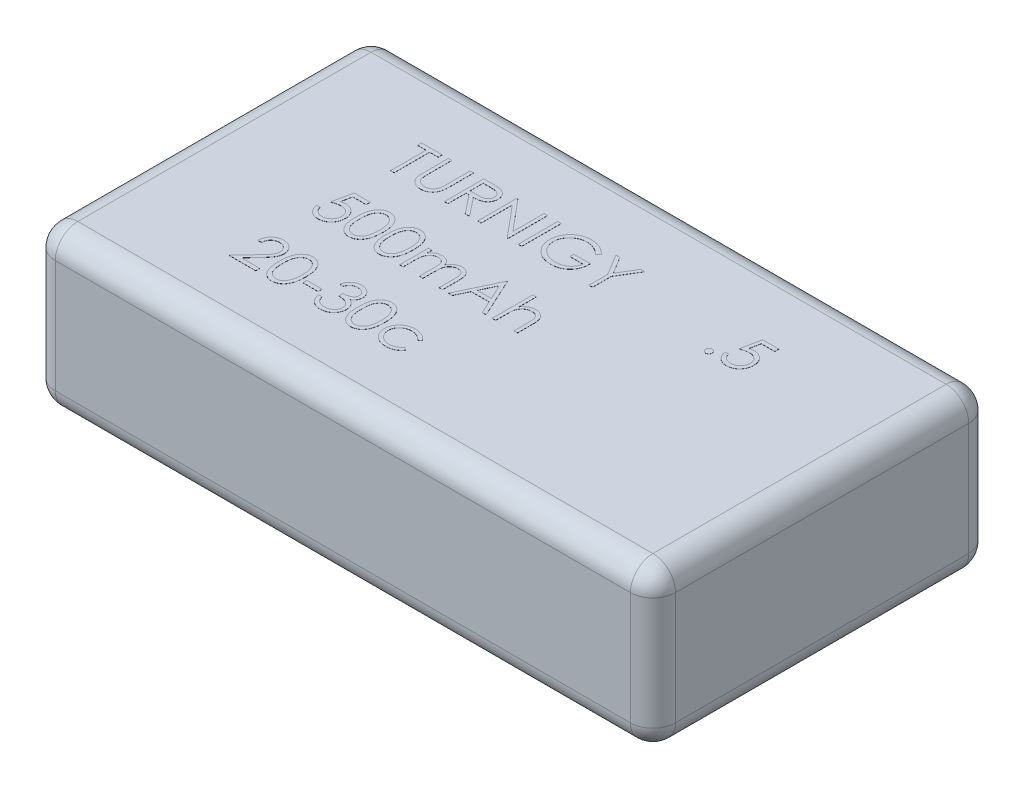
from build123d import *

# Parameters (mm, degrees)
SKETCH1_W           = 55
SKETCH1_H           = 30
BOSS_EXTRUDE1_DEPTH = 14
FILLET1_R           = 2
SKETCH4_W           = 0.314102564
SKETCH4_H           = 3.5
SKETCH4_W_2         = 1.346153846
SKETCH4_H_2         = 0.358974359
BOSS_EXTRUDE2_DEPTH = 0.01


with BuildPart() as part:
    # Sketch1 → Boss-Extrude1 (new body)
    with BuildSketch(Plane(origin=(0, 0, 0), x_dir=(1, 0, 0), z_dir=(0, 1, 0))):
        Rectangle(SKETCH1_W, SKETCH1_H)
    extrude(amount=BOSS_EXTRUDE1_DEPTH)

    # Fillet1
    fillet1_edges = [part.edges().sort_by_distance(p)[0] for p in [
        (-27.5, 14, 0),
        (0, 14, 15),
        (27.5, 14, 0),
        (0, 0, 15),
        (-27.5, 0, 0),
        (0, 0, -15),
        (27.5, 0, 0),
        (0, 14, -15),
        (27.5, 7, 15),
        (-27.5, 7, 15),
        (-27.5, 7, -15),
        (27.5, 7, -15),
    ]]
    fillet(fillet1_edges, radius=FILLET1_R)

    # Sketch4 → Boss-Extrude2 (add)
    # profile 1 of 21: a face of its own
    with BuildSketch(Plane(origin=(0, 14, 0), x_dir=(1, 0, 0), z_dir=(0, 1, 0))):
        Polygon((-16.287272911, 7.906605161), (-16.287272911, 8.26557952), (-14.447529321, 8.26557952), (-14.447529321, 7.906605161), (-15.210349834, 7.906605161), (-15.210349834, 4.76557952), (-15.524452398, 4.76557952), (-15.524452398, 7.906605161), align=None)
    # profile 2 of 21: a face of its own
    with BuildSketch(Plane(origin=(0, 14, 0), x_dir=(1, 0, 0), z_dir=(0, 1, 0))):
        with BuildLine():
            Line((-13.909067782, 8.26557952), (-13.594965218, 8.26557952))
            Line((-13.594965218, 8.26557952), (-13.594965218, 6.168524231))
            add(Edge.make_bspline(
                [(-13.594965218, 6.168524231), (-13.595011962, 6.138843496), (-13.595100667, 6.082519185), (-13.594508153, 6.002350884), (-13.592848785, 5.931078425), (-13.591802625, 5.868427078), (-13.589475292, 5.81468433), (-13.587577245, 5.769559019), (-13.585136688, 5.733264817), (-13.582203571, 5.712083891), (-13.580942782, 5.70297936)],
                knots=[0, 0, 0, 0, 1.528628734, 2.90083645, 4.128790002, 5.200304208, 6.127813768, 6.898992206, 7.526736466, 8, 8, 8, 8], degree=3))
            add(Edge.make_bspline(
                [(-13.580942782, 5.70297936), (-13.575765324, 5.670132596), (-13.565702137, 5.606289867), (-13.54005576, 5.515381585), (-13.504238259, 5.433450127), (-13.461795216, 5.357938836), (-13.405862605, 5.290949476), (-13.338859069, 5.229237823), (-13.257681301, 5.175266018), (-13.167420695, 5.125915207), (-13.070135458, 5.086250124), (-12.970724191, 5.05625676), (-12.870681212, 5.03797786), (-12.803705047, 5.035861321), (-12.770445988, 5.034810289)],
                knots=[0, 0, 0, 0, 1.035780045, 2.013197591, 2.933192213, 3.817615948, 4.702609284, 5.640816605, 6.646850145, 7.73207398, 8.84249596, 9.914020372, 10.964143139, 12, 12, 12, 12], degree=3))
            add(Edge.make_bspline(
                [(-12.770445988, 5.034810289), (-12.741892247, 5.035884139), (-12.684949685, 5.038025638), (-12.600343255, 5.051287069), (-12.517943146, 5.075187634), (-12.437342466, 5.106027393), (-12.361791482, 5.146774984), (-12.29124804, 5.193845823), (-12.228284105, 5.249056699), (-12.170826108, 5.310157044), (-12.120791172, 5.379096844), (-12.07742003, 5.454374982), (-12.0418941, 5.537124329), (-12.024350576, 5.595278751), (-12.015337815, 5.62515484)],
                knots=[0, 0, 0, 0, 0.994687771, 1.983630487, 2.973142513, 3.978332533, 4.983357753, 5.956394766, 6.925816176, 7.893390482, 8.871859704, 9.88551698, 10.913711441, 12, 12, 12, 12], degree=3))
            add(Edge.make_bspline(
                [(-12.015337815, 5.62515484), (-12.012337689, 5.637503415), (-12.005652201, 5.665021015), (-11.999405156, 5.711542305), (-11.992898631, 5.766431669), (-11.988384061, 5.830083482), (-11.98398284, 5.902284455), (-11.981349767, 5.983410712), (-11.980132735, 6.073167673), (-11.979770054, 6.135804835), (-11.979580603, 6.168524231)],
                knots=[0, 0, 0, 0, 0.558680831, 1.244966039, 2.062412453, 2.990489873, 4.051219941, 5.244515665, 6.560634259, 8, 8, 8, 8], degree=3))
            Line((-11.979580603, 6.168524231), (-11.979580603, 8.26557952))
            Line((-11.979580603, 8.26557952), (-11.665478039, 8.26557952))
            Line((-11.665478039, 8.26557952), (-11.665478039, 6.151697308))
            add(Edge.make_bspline(
                [(-11.665478039, 6.151697308), (-11.665732159, 6.113598929), (-11.666228091, 6.039247626), (-11.670528667, 5.930296267), (-11.677385667, 5.826943286), (-11.687073755, 5.72917479), (-11.699910758, 5.63734063), (-11.714185979, 5.550635862), (-11.732365512, 5.46968287), (-11.753598913, 5.393850452), (-11.777872461, 5.321664938), (-11.809313609, 5.253156324), (-11.844738109, 5.186241924), (-11.886752762, 5.121933815), (-11.933964145, 5.059947262), (-11.987415826, 5.000658187), (-12.045339986, 4.943119141), (-12.108699546, 4.888806075), (-12.176450071, 4.838997398), (-12.248390029, 4.795199627), (-12.323966799, 4.758176009), (-12.402983925, 4.727700085), (-12.485475128, 4.704785486), (-12.571442487, 4.68771033), (-12.661081681, 4.678008032), (-12.722046337, 4.676566102), (-12.752917943, 4.67583593)],
                knots=[0, 0, 0, 0, 1.316592851, 2.569410997, 3.76748051, 4.895814652, 5.963796859, 6.97159953, 7.931736103, 8.829262218, 9.692595152, 10.560224239, 11.431080259, 12.30701507, 13.211635791, 14.121146779, 15.063487852, 16.031507147, 17.00238618, 17.966455255, 18.938106653, 19.907068911, 20.888905087, 21.893141452, 22.933117798, 24, 24, 24, 24], degree=3))
            add(Edge.make_bspline(
                [(-12.752917943, 4.67583593), (-12.786587045, 4.676620695), (-12.852645704, 4.678160402), (-12.949983772, 4.686983152), (-13.043297968, 4.703601546), (-13.133573845, 4.72476149), (-13.219582342, 4.753945227), (-13.302475786, 4.788043352), (-13.380834467, 4.829920613), (-13.455929596, 4.876514006), (-13.525754352, 4.928938644), (-13.589851755, 4.986078818), (-13.648327626, 5.047019195), (-13.700196322, 5.112419561), (-13.746317207, 5.181771268), (-13.78604742, 5.255270508), (-13.820160664, 5.332888824), (-13.837767231, 5.386842024), (-13.846667943, 5.41411718)],
                knots=[0, 0, 0, 0, 1.13879206, 2.234305948, 3.301075583, 4.341971843, 5.366689343, 6.369221514, 7.369726634, 8.367512178, 9.355451585, 10.318319045, 11.268648973, 12.207971039, 13.137398894, 14.081662264, 15.030215811, 16, 16, 16, 16], degree=3))
            add(Edge.make_bspline(
                [(-13.846667943, 5.41411718), (-13.851845101, 5.432749755), (-13.863074472, 5.473164224), (-13.87509977, 5.540050712), (-13.885208852, 5.61706563), (-13.89471441, 5.704214248), (-13.900323368, 5.801564115), (-13.905240806, 5.909073031), (-13.909102425, 6.026870992), (-13.909079653, 6.108925508), (-13.909067782, 6.151697308)],
                knots=[0, 0, 0, 0, 0.625038921, 1.35572334, 2.194682327, 3.136881307, 4.189498639, 5.346923369, 6.617055217, 8, 8, 8, 8], degree=3))
            Line((-13.909067782, 6.151697308), (-13.909067782, 8.26557952))
        make_face()
    # profile 3 of 21: a face of its own
    with BuildSketch(Plane(origin=(0, 14, 0), x_dir=(1, 0, 0), z_dir=(0, 1, 0))):
        with BuildLine():
            Line((-10.768042141, 8.26557952), (-10.067621468, 8.26557952))
            add(Edge.make_bspline(
                [(-10.067621468, 8.26557952), (-10.02088034, 8.265423934), (-9.931132195, 8.265125192), (-9.802558925, 8.263459429), (-9.685731828, 8.258685073), (-9.580711989, 8.254576489), (-9.487501334, 8.247084548), (-9.405814043, 8.239923901), (-9.336026346, 8.23055024), (-9.293780494, 8.221844817), (-9.274652718, 8.217903238)],
                knots=[0, 0, 0, 0, 1.410062039, 2.707475311, 3.878576406, 4.937260626, 5.877586885, 6.699081471, 7.410979367, 8, 8, 8, 8], degree=3))
            add(Edge.make_bspline(
                [(-9.274652718, 8.217903238), (-9.249046094, 8.211576472), (-9.198379105, 8.199057909), (-9.125429039, 8.172598308), (-9.055914715, 8.141978683), (-8.99012489, 8.106014963), (-8.928389099, 8.064440183), (-8.870070788, 8.017972061), (-8.814905325, 7.966864855), (-8.765123695, 7.909830014), (-8.718184643, 7.849993504), (-8.678596017, 7.785289747), (-8.644469537, 7.71762822), (-8.61729902, 7.646320802), (-8.595421047, 7.57205903), (-8.579994807, 7.494170233), (-8.57074362, 7.413009258), (-8.569801764, 7.357651349), (-8.569324193, 7.329581924)],
                knots=[0, 0, 0, 0, 1.027469482, 2.033020251, 3.019912614, 3.986113645, 4.951240523, 5.91722682, 6.890402269, 7.87763091, 8.8651537, 9.85103654, 10.82876324, 11.815024772, 12.821070561, 13.842952187, 14.906261191, 16, 16, 16, 16], degree=3))
            add(Edge.make_bspline(
                [(-8.569324193, 7.329581924), (-8.570793191, 7.282946819), (-8.573659587, 7.191949651), (-8.60038469, 7.05988877), (-8.64416121, 6.936699455), (-8.704484499, 6.822536817), (-8.781303975, 6.719626172), (-8.873628766, 6.629235717), (-8.981510377, 6.553595804), (-9.081939693, 6.501142999), (-9.170653893, 6.467550091), (-9.243687206, 6.443913732), (-9.323354183, 6.425651767), (-9.408891518, 6.409291635), (-9.500655173, 6.39693994), (-9.598425213, 6.387893346), (-9.702271364, 6.382239297), (-9.773610434, 6.381397292), (-9.81030977, 6.380964135)],
                knots=[0, 0, 0, 0, 1.260483769, 2.459530307, 3.627416485, 4.787058657, 5.939039949, 7.08810263, 8.267026773, 9.491475466, 10.141966685, 10.831826277, 11.566392101, 12.351337768, 13.187381173, 14.07005841, 15.007169909, 16, 16, 16, 16], degree=3))
            Line((-9.81030977, 6.380964135), (-8.524452398, 4.76557952))
            Line((-8.524452398, 4.76557952), (-8.912873872, 4.76557952))
            Line((-8.912873872, 4.76557952), (-10.198731244, 6.380964135))
            Line((-10.198731244, 6.380964135), (-10.453939577, 6.380964135))
            Line((-10.453939577, 6.380964135), (-10.453939577, 4.76557952))
            Line((-10.453939577, 4.76557952), (-10.768042141, 4.76557952))
            Line((-10.768042141, 4.76557952), (-10.768042141, 8.26557952))
        make_face()
        with BuildLine():
            Line((-10.453939577, 7.906605161), (-10.453939577, 6.739938494))
            Line((-10.453939577, 6.739938494), (-9.813114257, 6.735030642))
            add(Edge.make_bspline(
                [(-9.813114257, 6.735030642), (-9.783194218, 6.735017405), (-9.725200661, 6.734991749), (-9.641299996, 6.738985525), (-9.563179884, 6.743528843), (-9.491139132, 6.750478189), (-9.425145557, 6.75943426), (-9.365232144, 6.770637245), (-9.311301092, 6.783689307), (-9.248402553, 6.803890933), (-9.178166022, 6.835896951), (-9.101834562, 6.88246245), (-9.036832224, 6.941031569), (-8.981914362, 7.008005025), (-8.937784931, 7.081641274), (-8.906672876, 7.161057643), (-8.886930434, 7.244249241), (-8.884601888, 7.301427349), (-8.883426757, 7.330283046)],
                knots=[0, 0, 0, 0, 1.146690395, 2.22261258, 3.21895312, 4.145990853, 4.996080663, 5.770904154, 6.481378293, 7.121626537, 8.300444488, 9.431385265, 10.535395872, 11.636531494, 12.74115979, 13.810798291, 14.895190096, 16, 16, 16, 16], degree=3))
            add(Edge.make_bspline(
                [(-8.883426757, 7.330283046), (-8.884628878, 7.358429619), (-8.887011043, 7.414205858), (-8.906459812, 7.495861768), (-8.939349193, 7.572928718), (-8.983671431, 7.645093203), (-9.037670586, 7.710598939), (-9.100988399, 7.766646092), (-9.171893594, 7.812895557), (-9.238164792, 7.842449937), (-9.297399005, 7.860569791), (-9.348828665, 7.873320954), (-9.406940143, 7.883565423), (-9.472015601, 7.891773484), (-9.543777232, 7.898828429), (-9.622587883, 7.903580207), (-9.707924663, 7.906394071), (-9.767071594, 7.90653316), (-9.797689577, 7.906605161)],
                knots=[0, 0, 0, 0, 1.101028733, 2.181837193, 3.264309656, 4.369019818, 5.486613113, 6.575447106, 7.666700264, 8.788928104, 9.402425223, 10.0903467, 10.862060571, 11.710948788, 12.657782767, 13.684531032, 14.801375019, 16, 16, 16, 16], degree=3))
            Line((-9.797689577, 7.906605161), (-10.453939577, 7.906605161))
        make_face(mode=Mode.SUBTRACT)
    # profile 4 of 21: a face of its own
    with BuildSketch(Plane(origin=(0, 14, 0), x_dir=(1, 0, 0), z_dir=(0, 1, 0))):
        Polygon((-7.80650368, 4.76557952), (-7.80650368, 8.26557952), (-7.740598231, 8.26557952), (-5.428298552, 5.510871988), (-5.428298552, 8.26557952), (-5.114195988, 8.26557952), (-5.114195988, 4.76557952), (-5.185710411, 4.76557952), (-7.492401116, 7.513976956), (-7.492401116, 4.76557952), align=None)
    # profile 5 of 21: a face of its own
    with BuildSketch(Plane(origin=(0, 14, 0), x_dir=(1, 0, 0), z_dir=(0, 1, 0))):
        with Locations((-4.059708808, 6.51557952)):
            Rectangle(SKETCH4_W, SKETCH4_H)
    # profile 6 of 21: a face of its own
    with BuildSketch(Plane(origin=(0, 14, 0), x_dir=(1, 0, 0), z_dir=(0, 1, 0))):
        with BuildLine():
            Line((0.270419397, 7.668223751), (0.001188628, 7.413015417))
            add(Edge.make_bspline(
                [(0.001188628, 7.413015417), (-0.04753026, 7.45884628), (-0.143806307, 7.549415143), (-0.30076655, 7.666926138), (-0.464530184, 7.767592239), (-0.63424268, 7.849498475), (-0.805701234, 7.914851235), (-0.976630011, 7.961379376), (-1.145275712, 7.991051913), (-1.25744293, 7.994600283), (-1.312713616, 7.996348751)],
                knots=[0, 0, 0, 0, 1.08915593, 2.152340314, 3.188132944, 4.216796309, 5.218260357, 6.173443236, 7.099959455, 8, 8, 8, 8], degree=3))
            add(Edge.make_bspline(
                [(-1.312713616, 7.996348751), (-1.346628316, 7.995935145), (-1.414369756, 7.995109006), (-1.5149917, 7.98456479), (-1.614558337, 7.969399926), (-1.712881712, 7.947458049), (-1.810152999, 7.919648989), (-1.906033891, 7.884863526), (-2.000703246, 7.844308282), (-2.093269327, 7.797445808), (-2.18300983, 7.745965961), (-2.267766666, 7.688917421), (-2.348080065, 7.628128631), (-2.42244049, 7.562077652), (-2.491275677, 7.491362786), (-2.556224049, 7.41729948), (-2.615001344, 7.337864262), (-2.668092509, 7.254518636), (-2.715454128, 7.168726446), (-2.757262781, 7.081313457), (-2.792359869, 6.992569602), (-2.820129325, 6.902383525), (-2.843039979, 6.811452935), (-2.859157586, 6.719148214), (-2.868244308, 6.625370529), (-2.869816088, 6.56257327), (-2.870606244, 6.531004199)],
                knots=[0, 0, 0, 0, 1.02818874, 2.053710826, 3.065248034, 4.081641283, 5.106893873, 6.131558223, 7.173050175, 8.228653731, 9.27666206, 10.308777013, 11.325269123, 12.329503258, 13.32196095, 14.316845687, 15.314881793, 16.315733098, 17.311955233, 18.285320748, 19.252783886, 20.203351036, 21.145449891, 22.095197417, 23.042428769, 24, 24, 24, 24], degree=3))
            add(Edge.make_bspline(
                [(-2.870606244, 6.531004199), (-2.869850526, 6.498733382), (-2.868341153, 6.434279869), (-2.858680833, 6.338085796), (-2.840752593, 6.243320394), (-2.816784884, 6.14967226), (-2.786804068, 6.056981013), (-2.749431402, 5.965648503), (-2.705165802, 5.875678111), (-2.65392925, 5.787880495), (-2.597743046, 5.702357471), (-2.534799965, 5.621797949), (-2.467939382, 5.545129172), (-2.394725482, 5.474053408), (-2.31750594, 5.406669512), (-2.233973664, 5.34483399), (-2.145771203, 5.287355767), (-2.052763991, 5.234959248), (-1.955961209, 5.188150712), (-1.856704456, 5.146526816), (-1.75467664, 5.112247478), (-1.650413951, 5.084309374), (-1.544040679, 5.061409077), (-1.435016876, 5.046676597), (-1.324144168, 5.035985766), (-1.249405536, 5.035204096), (-1.211752077, 5.034810289)],
                knots=[0, 0, 0, 0, 0.93586088, 1.869166235, 2.799637598, 3.729985548, 4.670839027, 5.622275134, 6.589130586, 7.576015415, 8.568469353, 9.55398029, 10.53834874, 11.515998671, 12.510579167, 13.508179873, 14.527009472, 15.561807829, 16.601455013, 17.643573243, 18.680854198, 19.719860599, 20.772568776, 21.833555941, 22.908541556, 24, 24, 24, 24], degree=3))
            add(Edge.make_bspline(
                [(-1.211752077, 5.034810289), (-1.16637373, 5.035758865), (-1.077265973, 5.037621549), (-0.94627953, 5.052121839), (-0.820476459, 5.074768632), (-0.700210256, 5.107934529), (-0.585341235, 5.150238204), (-0.475448294, 5.20123359), (-0.371396636, 5.262876649), (-0.272873462, 5.332450516), (-0.182116276, 5.409965349), (-0.100262152, 5.493609804), (-0.028616663, 5.582977871), (0.033888036, 5.677543186), (0.08559669, 5.778088491), (0.128039486, 5.884121054), (0.160572777, 5.995688565), (0.173927752, 6.072780197), (0.180675807, 6.111733366)],
                knots=[0, 0, 0, 0, 1.13008108, 2.219097802, 3.278683437, 4.311054135, 5.322181354, 6.324827112, 7.324222904, 8.330512327, 9.32562643, 10.293043162, 11.24128371, 12.174520618, 13.111833804, 14.052305215, 15.015860969, 16, 16, 16, 16], degree=3))
            Line((0.180675807, 6.111733366), (-0.985990859, 6.111733366))
            Line((-0.985990859, 6.111733366), (-0.985990859, 6.470707725))
            Line((-0.985990859, 6.470707725), (0.494778371, 6.470707725))
            add(Edge.make_bspline(
                [(0.494778371, 6.470707725), (0.493072523, 6.403800236), (0.48973387, 6.272850194), (0.466314954, 6.081879924), (0.428498442, 5.90150823), (0.37683813, 5.731545159), (0.309962849, 5.572231566), (0.228590321, 5.4234057), (0.1314182, 5.286029019), (0.021907758, 5.158980015), (-0.100992199, 5.045650803), (-0.233960819, 4.946044865), (-0.377217788, 4.86214225), (-0.530627595, 4.793881587), (-0.693688029, 4.740607592), (-0.866776408, 4.702836016), (-1.049658009, 4.680206052), (-1.174994686, 4.677314673), (-1.239095827, 4.67583593)],
                knots=[0, 0, 0, 0, 1.140356446, 2.231883559, 3.274166699, 4.278491846, 5.25512956, 6.21435461, 7.1637429, 8.11826594, 9.068280886, 10.0076534, 10.945064095, 11.891975133, 12.864533718, 13.863980011, 14.907571808, 16, 16, 16, 16], degree=3))
            add(Edge.make_bspline(
                [(-1.239095827, 4.67583593), (-1.278605963, 4.676405051), (-1.356532684, 4.677527542), (-1.471623612, 4.685504889), (-1.583541232, 4.697785466), (-1.692269241, 4.716330589), (-1.798207583, 4.739045243), (-1.900827168, 4.768131962), (-2.00051891, 4.801800661), (-2.097436896, 4.840096335), (-2.190701443, 4.884467991), (-2.28072796, 4.933777631), (-2.368014085, 4.987770992), (-2.45196525, 5.047381837), (-2.533018872, 5.112164298), (-2.610652315, 5.182248217), (-2.685300194, 5.257419336), (-2.732060657, 5.310798346), (-2.75562227, 5.337694904)],
                knots=[0, 0, 0, 0, 1.107784379, 2.184907829, 3.233506516, 4.263428166, 5.276301166, 6.270063455, 7.25232949, 8.225834625, 9.190232166, 10.146266622, 11.1027726, 12.066435141, 13.031522626, 14.010570082, 14.99756817, 16, 16, 16, 16], degree=3))
            add(Edge.make_bspline(
                [(-2.75562227, 5.337694904), (-2.789808202, 5.380365557), (-2.857612614, 5.464998575), (-2.944890771, 5.600598519), (-3.019292174, 5.741000379), (-3.079659996, 5.886595008), (-3.126798082, 6.03724622), (-3.160604335, 6.192761512), (-3.180411624, 6.353341142), (-3.183265162, 6.462006407), (-3.184708808, 6.516981763)],
                knots=[0, 0, 0, 0, 1.023165419, 2.029347347, 3.013907458, 3.994755782, 4.975994455, 5.96558838, 6.970761222, 8, 8, 8, 8], degree=3))
            add(Edge.make_bspline(
                [(-3.184708808, 6.516981763), (-3.18417657, 6.558148016), (-3.183118858, 6.639957324), (-3.170293342, 6.761414631), (-3.151891924, 6.880715323), (-3.124844869, 6.997761879), (-3.090748605, 7.112632471), (-3.048195119, 7.225380435), (-2.998650223, 7.336072307), (-2.941064727, 7.443946175), (-2.876980267, 7.547570588), (-2.807430047, 7.646528391), (-2.731426447, 7.739017456), (-2.650210647, 7.826209104), (-2.562813657, 7.907007951), (-2.470054233, 7.982162062), (-2.37186089, 8.051772248), (-2.26792471, 8.114742082), (-2.159797026, 8.171305703), (-2.047737024, 8.220894915), (-1.931778913, 8.26187823), (-1.812791436, 8.29665201), (-1.689873935, 8.32236715), (-1.563918398, 8.341015896), (-1.434268286, 8.353776495), (-1.346632257, 8.354802751), (-1.302196789, 8.35532311)],
                knots=[0, 0, 0, 0, 1.008945113, 2.00506715, 2.99143336, 3.967273523, 4.948097931, 5.927297278, 6.919902385, 7.919676788, 8.923139349, 9.905703106, 10.883022732, 11.856032218, 12.825136022, 13.798837087, 14.781400844, 15.773989409, 16.776158564, 17.77167057, 18.775803737, 19.789618931, 20.80898985, 21.851988756, 22.910860228, 24, 24, 24, 24], degree=3))
            add(Edge.make_bspline(
                [(-1.302196789, 8.35532311), (-1.265958545, 8.354743618), (-1.194102367, 8.353594554), (-1.087176634, 8.345629906), (-0.98190362, 8.333006025), (-0.87812723, 8.315779238), (-0.776200863, 8.292315548), (-0.675834158, 8.264237263), (-0.576881622, 8.23154544), (-0.479653373, 8.192556594), (-0.383495657, 8.148302969), (-0.287873816, 8.098489547), (-0.19311457, 8.042264542), (-0.099053589, 7.979461007), (-0.005097731, 7.911157589), (0.087266912, 7.835400765), (0.180269856, 7.755178009), (0.24007167, 7.697495825), (0.270419397, 7.668223751)],
                knots=[0, 0, 0, 0, 0.985871117, 1.954866573, 2.915460327, 3.869826059, 4.81536089, 5.759505086, 6.70452669, 7.649098992, 8.607881297, 9.583363685, 10.581137262, 11.603961102, 12.659522466, 13.73993555, 14.853081303, 16, 16, 16, 16], degree=3))
        make_face()
    # profile 7 of 21: a face of its own
    with BuildSketch(Plane(origin=(0, 14, 0), x_dir=(1, 0, 0), z_dir=(0, 1, 0))):
        Polygon((0.94349632, 8.26557952), (1.303171801, 8.26557952), (2.223043596, 6.76167327), (3.141513147, 8.26557952), (3.501188628, 8.26557952), (2.379393756, 6.429341539), (2.379393756, 4.76557952), (2.065291192, 4.76557952), (2.065291192, 6.429341539), align=None)
    # profile 8 of 21: a face of its own
    with BuildSketch(Plane(origin=(0, 14, 0), x_dir=(1, 0, 0), z_dir=(0, 1, 0))):
        with BuildLine():
            add(Edge.make_bspline(
                [(12.453111705, 5.304041058), (12.472601917, 5.302882892), (12.510810199, 5.300612441), (12.566049328, 5.285035767), (12.616043987, 5.257377107), (12.660576232, 5.220514329), (12.697282709, 5.175818666), (12.725927061, 5.126222757), (12.741368046, 5.070521164), (12.743621958, 5.032091489), (12.744778371, 5.012374392)],
                knots=[0, 0, 0, 0, 1.020151414, 1.999887582, 2.974338812, 3.990962822, 5.007586832, 5.987933904, 6.967670073, 8, 8, 8, 8], degree=3))
            add(Edge.make_bspline(
                [(12.744778371, 5.012374392), (12.743582771, 4.993131062), (12.741225063, 4.955183498), (12.725962455, 4.899902036), (12.697064405, 4.850275131), (12.660829412, 4.804972993), (12.616032979, 4.768032122), (12.565931132, 4.740608778), (12.510939874, 4.723916798), (12.472623551, 4.721790501), (12.453111705, 4.720707725)],
                knots=[0, 0, 0, 0, 1.009421747, 1.99056486, 2.972319754, 3.999869655, 5.017953583, 5.993804169, 6.978383603, 8, 8, 8, 8], degree=3))
            add(Edge.make_bspline(
                [(12.453111705, 4.720707725), (12.433585799, 4.721751322), (12.395466116, 4.723788697), (12.340680122, 4.740951504), (12.290273154, 4.767774964), (12.245485442, 4.805041873), (12.20894697, 4.850042017), (12.181321587, 4.900243813), (12.164731438, 4.95502525), (12.162549566, 4.993099893), (12.161445038, 5.012374392)],
                knots=[0, 0, 0, 0, 1.022052826, 1.995314843, 2.982371812, 4.00089066, 5.028879526, 6.005146991, 6.990147033, 8, 8, 8, 8], degree=3))
            add(Edge.make_bspline(
                [(12.161445038, 5.012374392), (12.162507137, 5.032123771), (12.164580756, 5.070682011), (12.181356416, 5.125881119), (12.208732628, 5.176049558), (12.245738023, 5.220446138), (12.290262319, 5.257633441), (12.340558524, 5.284698234), (12.395598064, 5.300738646), (12.433608003, 5.302921163), (12.453111705, 5.304041058)],
                knots=[0, 0, 0, 0, 1.032775665, 2.016367738, 2.991239715, 4.008302682, 5.025365648, 6.011011707, 6.979408107, 8, 8, 8, 8], degree=3))
        make_face()
    # profile 9 of 21: a face of its own
    with BuildSketch(Plane(origin=(0, 14, 0), x_dir=(1, 0, 0), z_dir=(0, 1, 0))):
        with BuildLine():
            Line((15.392214269, 8.26557952), (15.392214269, 7.906605161))
            Line((15.392214269, 7.906605161), (14.201709461, 7.906605161))
            Line((14.201709461, 7.906605161), (14.013107698, 6.986032244))
            add(Edge.make_bspline(
                [(14.013107698, 6.986032244), (14.050163573, 6.996262516), (14.121953468, 7.01608205), (14.227913329, 7.03808782), (14.328505533, 7.051353264), (14.393780903, 7.053164575), (14.425367314, 7.054041058)],
                knots=[0, 0, 0, 0, 1.100273476, 2.13160584, 3.095893838, 4, 4, 4, 4], degree=3))
            add(Edge.make_bspline(
                [(14.425367314, 7.054041058), (14.464451053, 7.053195123), (14.541299451, 7.051531802), (14.653738398, 7.035559952), (14.761071291, 7.010420038), (14.863073661, 6.975299516), (14.959934212, 6.930389783), (15.050761773, 6.874289842), (15.136919686, 6.808756511), (15.21686228, 6.733411499), (15.289386588, 6.650489882), (15.353152578, 6.561332011), (15.407315168, 6.466804349), (15.450875923, 6.366003741), (15.485660257, 6.260044587), (15.508812252, 6.147812005), (15.524228961, 6.030363885), (15.525951348, 5.950059315), (15.526829653, 5.909109167)],
                knots=[0, 0, 0, 0, 1.052922333, 2.070308379, 3.05430497, 4.020497103, 4.973039431, 5.925935799, 6.892292201, 7.88610001, 8.88166317, 9.857072816, 10.836096531, 11.812156883, 12.81219415, 13.836441305, 14.89672472, 16, 16, 16, 16], degree=3))
            add(Edge.make_bspline(
                [(15.526829653, 5.909109167), (15.526164578, 5.880586947), (15.524843415, 5.823927959), (15.518124828, 5.739783759), (15.505189112, 5.657420926), (15.487821388, 5.576828534), (15.46527897, 5.498159162), (15.437989916, 5.421187634), (15.404593888, 5.346393027), (15.367962513, 5.273067632), (15.326716035, 5.202869125), (15.280937528, 5.137220138), (15.232572036, 5.075135857), (15.180530651, 5.017282124), (15.124329656, 4.964039106), (15.064649689, 4.915090824), (15.00196697, 4.869609494), (14.935311728, 4.829441299), (14.866169245, 4.792478343), (14.793541028, 4.762154805), (14.719080327, 4.735044277), (14.641715452, 4.71343475), (14.561621639, 4.696502195), (14.478666863, 4.685001594), (14.393286193, 4.676625157), (14.335411181, 4.6761008), (14.306176609, 4.67583593)],
                knots=[0, 0, 0, 0, 1.056347294, 2.098418968, 3.122841568, 4.141288669, 5.149314143, 6.15115421, 7.162517403, 8.180376062, 9.185164535, 10.17417709, 11.141909838, 12.097768115, 13.052685741, 14.0056014, 14.954263652, 15.917497458, 16.885230207, 17.854509472, 18.828990115, 19.81800267, 20.826176721, 21.857883937, 22.917946725, 24, 24, 24, 24], degree=3))
            add(Edge.make_bspline(
                [(14.306176609, 4.67583593), (14.271302428, 4.676526768), (14.202691597, 4.67788591), (14.10217103, 4.692104395), (14.005456424, 4.712468312), (13.913326323, 4.743104582), (13.824955059, 4.781491876), (13.741532342, 4.830008048), (13.660926566, 4.884987152), (13.586414529, 4.949867505), (13.517258415, 5.020783187), (13.455351907, 5.097740828), (13.40021833, 5.17947027), (13.352740583, 5.266368424), (13.312242562, 5.358206955), (13.280427573, 5.455329956), (13.254749218, 5.55722996), (13.243885798, 5.62738347), (13.238368115, 5.663015417)],
                knots=[0, 0, 0, 0, 1.0467383, 2.05933395, 3.04377827, 4.011590433, 4.970194871, 5.932262533, 6.905835911, 7.896367577, 8.894135286, 9.877477877, 10.858688626, 11.851381753, 12.8477658, 13.868841284, 14.917554742, 16, 16, 16, 16], degree=3))
            Line((13.238368115, 5.663015417), (13.552470679, 5.663015417))
            add(Edge.make_bspline(
                [(13.552470679, 5.663015417), (13.560199236, 5.629638965), (13.575053953, 5.56548757), (13.607659702, 5.475356229), (13.647525577, 5.395037005), (13.694929926, 5.323467422), (13.751479956, 5.261058424), (13.816009385, 5.205441362), (13.888357108, 5.155266233), (13.968750338, 5.113443466), (14.053563417, 5.077774713), (14.142330627, 5.054023018), (14.232634973, 5.037322125), (14.293713344, 5.035650364), (14.324405775, 5.034810289)],
                knots=[0, 0, 0, 0, 1.136247022, 2.183929868, 3.172523383, 4.106158343, 5.02341133, 5.958108904, 6.928429099, 7.938127109, 8.96079061, 9.975095812, 10.982467395, 12, 12, 12, 12], degree=3))
            add(Edge.make_bspline(
                [(14.324405775, 5.034810289), (14.35436422, 5.035631067), (14.413352642, 5.037247185), (14.500164028, 5.049686198), (14.583976903, 5.068843769), (14.663964259, 5.097513624), (14.741525799, 5.132358342), (14.814699569, 5.177073418), (14.885602447, 5.228533436), (14.95203058, 5.287490067), (15.012870029, 5.352459761), (15.066626151, 5.421937155), (15.111403064, 5.496054001), (15.149137173, 5.573527154), (15.177790472, 5.655205711), (15.198231453, 5.740706886), (15.210234512, 5.830241867), (15.211885692, 5.891311176), (15.212727089, 5.922430481)],
                knots=[0, 0, 0, 0, 1.027316725, 2.022795036, 3.002884548, 3.971462791, 4.93288096, 5.914575861, 6.907176829, 7.935150275, 8.956128384, 9.956726525, 10.942570165, 11.921478529, 12.907843606, 13.90538589, 14.932640048, 16, 16, 16, 16], degree=3))
            add(Edge.make_bspline(
                [(15.212727089, 5.922430481), (15.21206861, 5.950506233), (15.21077973, 6.005460522), (15.20024916, 6.085859729), (15.181932187, 6.161932771), (15.156508307, 6.234047005), (15.1242288, 6.302270447), (15.084782487, 6.366673507), (15.037429089, 6.426407341), (14.983337201, 6.481499894), (14.92407916, 6.532344769), (14.858635417, 6.575688856), (14.78837549, 6.612152773), (14.714145891, 6.643620771), (14.634180992, 6.666221517), (14.55006436, 6.683189402), (14.460887652, 6.693004765), (14.399916964, 6.694366653), (14.368576448, 6.695066699)],
                knots=[0, 0, 0, 0, 1.045622112, 2.046656509, 3.013763289, 3.955457236, 4.890082067, 5.820317437, 6.762574623, 7.722996705, 8.69280354, 9.665887285, 10.63943826, 11.638615906, 12.663482002, 13.728887084, 14.832589034, 16, 16, 16, 16], degree=3))
            add(Edge.make_bspline(
                [(14.368576448, 6.695066699), (14.341447519, 6.694486108), (14.285433164, 6.693287335), (14.199510337, 6.684460838), (14.109218614, 6.670221544), (14.014904119, 6.650635296), (13.916283611, 6.625004219), (13.81356521, 6.594289719), (13.706532943, 6.55756772), (13.634415219, 6.529835506), (13.597342474, 6.51557952)],
                knots=[0, 0, 0, 0, 0.817624296, 1.688186739, 2.600797293, 3.572016777, 4.590301741, 5.671205678, 6.80286297, 8, 8, 8, 8], degree=3))
            Line((13.597342474, 6.51557952), (13.956316833, 8.26557952))
            Line((13.956316833, 8.26557952), (15.392214269, 8.26557952))
        make_face()
    # profile 10 of 21: a face of its own
    with BuildSketch(Plane(origin=(0, 14, 0), x_dir=(1, 0, 0), z_dir=(0, 1, 0))):
        with BuildLine():
            Line((-13.998811372, 1.432246187), (-13.998811372, 1.073271828))
            Line((-13.998811372, 1.073271828), (-15.18931618, 1.073271828))
            Line((-15.18931618, 1.073271828), (-15.377917943, 0.152698911))
            add(Edge.make_bspline(
                [(-15.377917943, 0.152698911), (-15.340862068, 0.162929183), (-15.269072173, 0.182748716), (-15.163112312, 0.204754487), (-15.062520108, 0.218019931), (-14.997244738, 0.219831241), (-14.965658327, 0.220707725)],
                knots=[0, 0, 0, 0, 1.100273476, 2.13160584, 3.095893838, 4, 4, 4, 4], degree=3))
            add(Edge.make_bspline(
                [(-14.965658327, 0.220707725), (-14.926574588, 0.219861789), (-14.84972619, 0.218198468), (-14.737287243, 0.202226619), (-14.62995435, 0.177086704), (-14.52795198, 0.141966183), (-14.431091429, 0.097056449), (-14.340263868, 0.040956509), (-14.254105955, -0.024576822), (-14.174163361, -0.099921834), (-14.101639053, -0.182843451), (-14.037873063, -0.272001322), (-13.983710473, -0.366528984), (-13.940149718, -0.467329593), (-13.905365384, -0.573288746), (-13.882213389, -0.685521329), (-13.86679668, -0.802969449), (-13.865074293, -0.883274019), (-13.864195988, -0.924224166)],
                knots=[0, 0, 0, 0, 1.052922333, 2.070308379, 3.05430497, 4.020497103, 4.973039431, 5.925935799, 6.892292201, 7.88610001, 8.88166317, 9.857072816, 10.836096531, 11.812156883, 12.81219415, 13.836441305, 14.89672472, 16, 16, 16, 16], degree=3))
            add(Edge.make_bspline(
                [(-13.864195988, -0.924224166), (-13.864861063, -0.952746386), (-13.866182226, -1.009405374), (-13.872900813, -1.093549575), (-13.885836529, -1.175912408), (-13.903204253, -1.2565048), (-13.925746671, -1.335174172), (-13.953035725, -1.4121457), (-13.986431753, -1.486940306), (-14.023063128, -1.560265701), (-14.064309606, -1.630464209), (-14.110088113, -1.696113195), (-14.158453605, -1.758197477), (-14.21049499, -1.81605121), (-14.266695985, -1.869294228), (-14.326375952, -1.918242509), (-14.389058671, -1.963723839), (-14.455713913, -2.003892035), (-14.524856396, -2.040854991), (-14.597484613, -2.071178528), (-14.671945314, -2.098289056), (-14.74931019, -2.119898584), (-14.829404002, -2.136831138), (-14.912358778, -2.148331739), (-14.997739448, -2.156708176), (-15.05561446, -2.157232533), (-15.084849032, -2.157497403)],
                knots=[0, 0, 0, 0, 1.056347294, 2.098418968, 3.122841568, 4.141288669, 5.149314143, 6.15115421, 7.162517403, 8.180376062, 9.185164535, 10.17417709, 11.141909838, 12.097768115, 13.052685741, 14.0056014, 14.954263652, 15.917497458, 16.885230207, 17.854509472, 18.828990115, 19.81800267, 20.826176721, 21.857883937, 22.917946725, 24, 24, 24, 24], degree=3))
            add(Edge.make_bspline(
                [(-15.084849032, -2.157497403), (-15.119723213, -2.156806565), (-15.188334044, -2.155447423), (-15.288854611, -2.141228938), (-15.385569217, -2.120865021), (-15.477699318, -2.090228752), (-15.566070582, -2.051841457), (-15.649493299, -2.003325285), (-15.730099075, -1.948346182), (-15.804611112, -1.883465829), (-15.873767226, -1.812550147), (-15.935673734, -1.735592506), (-15.990807311, -1.653863063), (-16.038285058, -1.566964909), (-16.078783079, -1.475126378), (-16.110598068, -1.378003378), (-16.136276423, -1.276103374), (-16.147139843, -1.205949863), (-16.152657526, -1.170317916)],
                knots=[0, 0, 0, 0, 1.0467383, 2.05933395, 3.04377827, 4.011590433, 4.970194871, 5.932262533, 6.905835911, 7.896367577, 8.894135286, 9.877477877, 10.858688626, 11.851381753, 12.8477658, 13.868841284, 14.917554742, 16, 16, 16, 16], degree=3))
            Line((-16.152657526, -1.170317916), (-15.838554962, -1.170317916))
            add(Edge.make_bspline(
                [(-15.838554962, -1.170317916), (-15.830826405, -1.203694368), (-15.815971688, -1.267845763), (-15.783365939, -1.357977105), (-15.743500064, -1.438296328), (-15.696095716, -1.509865912), (-15.639545685, -1.572274909), (-15.575016256, -1.627891971), (-15.502668533, -1.6780671), (-15.422275303, -1.719889867), (-15.337462224, -1.755558621), (-15.248695014, -1.779310316), (-15.158390668, -1.796011209), (-15.097312297, -1.797682969), (-15.066619866, -1.798523044)],
                knots=[0, 0, 0, 0, 1.136247022, 2.183929868, 3.172523383, 4.106158343, 5.02341133, 5.958108904, 6.928429099, 7.938127109, 8.96079061, 9.975095812, 10.982467395, 12, 12, 12, 12], degree=3))
            add(Edge.make_bspline(
                [(-15.066619866, -1.798523044), (-15.036661421, -1.797702266), (-14.977672999, -1.796086148), (-14.890861613, -1.783647136), (-14.807048738, -1.764489565), (-14.727061382, -1.73581971), (-14.649499842, -1.700974991), (-14.576326072, -1.656259915), (-14.505423194, -1.604799897), (-14.438995061, -1.545843267), (-14.378155612, -1.480873572), (-14.324399491, -1.411396179), (-14.279622577, -1.337279332), (-14.241888468, -1.259806179), (-14.213235169, -1.178127622), (-14.192794188, -1.092626447), (-14.180791129, -1.003091467), (-14.179139949, -0.942022157), (-14.178298552, -0.910902852)],
                knots=[0, 0, 0, 0, 1.027316725, 2.022795036, 3.002884548, 3.971462791, 4.93288096, 5.914575861, 6.907176829, 7.935150275, 8.956128384, 9.956726525, 10.942570165, 11.921478529, 12.907843606, 13.90538589, 14.932640048, 16, 16, 16, 16], degree=3))
            add(Edge.make_bspline(
                [(-14.178298552, -0.910902852), (-14.178957031, -0.8828271), (-14.180245911, -0.827872811), (-14.190776481, -0.747473605), (-14.209093454, -0.671400563), (-14.234517334, -0.599286329), (-14.266796841, -0.531062886), (-14.306243154, -0.466659826), (-14.353596552, -0.406925993), (-14.40768844, -0.351833439), (-14.466946481, -0.300988564), (-14.532390224, -0.257644478), (-14.602650151, -0.22118056), (-14.67687975, -0.189712562), (-14.756844649, -0.167111816), (-14.840961281, -0.150143931), (-14.930137989, -0.140328568), (-14.991108677, -0.13896668), (-15.022449193, -0.138266634)],
                knots=[0, 0, 0, 0, 1.045622112, 2.046656509, 3.013763289, 3.955457236, 4.890082067, 5.820317437, 6.762574623, 7.722996705, 8.69280354, 9.665887285, 10.63943826, 11.638615906, 12.663482002, 13.728887084, 14.832589034, 16, 16, 16, 16], degree=3))
            add(Edge.make_bspline(
                [(-15.022449193, -0.138266634), (-15.049578122, -0.138847225), (-15.105592477, -0.140045999), (-15.191515304, -0.148872495), (-15.281807027, -0.16311179), (-15.376121522, -0.182698037), (-15.47474203, -0.208329114), (-15.577460431, -0.239043615), (-15.684492698, -0.275765613), (-15.756610422, -0.303497827), (-15.793683167, -0.317753813)],
                knots=[0, 0, 0, 0, 0.817624296, 1.688186739, 2.600797293, 3.572016777, 4.590301741, 5.671205678, 6.80286297, 8, 8, 8, 8], degree=3))
            Line((-15.793683167, -0.317753813), (-15.434708808, 1.432246187))
            Line((-15.434708808, 1.432246187), (-13.998811372, 1.432246187))
        make_face()
    # profile 11 of 21: a face of its own
    with BuildSketch(Plane(origin=(0, 14, 0), x_dir=(1, 0, 0), z_dir=(0, 1, 0))):
        with BuildLine():
            add(Edge.make_bspline(
                [(-13.505221629, -0.319156057), (-13.50489361, -0.263058669), (-13.50425643, -0.154088685), (-13.49716801, 0.004695957), (-13.485392667, 0.153656246), (-13.469255294, 0.292799312), (-13.449617314, 0.422161077), (-13.423401828, 0.541395834), (-13.393589025, 0.65105544), (-13.359036579, 0.751497489), (-13.32004879, 0.844075192), (-13.277614529, 0.930500393), (-13.230049735, 1.010642325), (-13.180072822, 1.085780116), (-13.12566075, 1.154683811), (-13.06836196, 1.218326473), (-13.005940084, 1.275237224), (-12.940517075, 1.327083526), (-12.871500611, 1.372532998), (-12.800857945, 1.412565736), (-12.728102839, 1.446765604), (-12.653036656, 1.473656039), (-12.576334098, 1.495866886), (-12.497727032, 1.511055834), (-12.417085668, 1.520612742), (-12.362654233, 1.52152641), (-12.335049353, 1.521989776)],
                knots=[0, 0, 0, 0, 1.646270934, 3.197905019, 4.663502075, 6.030701355, 7.308322542, 8.50163776, 9.611534131, 10.641858119, 11.616356847, 12.558055219, 13.465016945, 14.349605745, 15.204443733, 16.039544428, 16.859896111, 17.680448484, 18.487036065, 19.28249412, 20.06191084, 20.843045899, 21.620316918, 22.403196591, 23.190181807, 24, 24, 24, 24], degree=3))
            add(Edge.make_bspline(
                [(-12.335049353, 1.521989776), (-12.307213875, 1.521501961), (-12.251857866, 1.52053185), (-12.17001749, 1.511207908), (-12.090067809, 1.495736785), (-12.01234967, 1.47381581), (-11.936224683, 1.446620133), (-11.862288276, 1.412533016), (-11.790081194, 1.372854149), (-11.720750907, 1.326230272), (-11.653536291, 1.274247995), (-11.590088328, 1.215485327), (-11.530401242, 1.150535607), (-11.473725937, 1.080093743), (-11.42167034, 1.002808659), (-11.372096908, 0.920024549), (-11.327724872, 0.830293684), (-11.284990197, 0.735113216), (-11.24810321, 0.631849557), (-11.214836965, 0.521084797), (-11.187957996, 0.40151061), (-11.165568724, 0.273754365), (-11.148223828, 0.137346881), (-11.135591186, -0.007419434), (-11.128918101, -0.160639825), (-11.127661399, -0.265397674), (-11.1270165, -0.319156057)],
                knots=[0, 0, 0, 0, 0.810914788, 1.612654377, 2.396697861, 3.181598691, 3.963628158, 4.749916497, 5.551656086, 6.361998678, 7.18212741, 8.025565596, 8.878627764, 9.750805457, 10.657531673, 11.591944965, 12.560506719, 13.57287815, 14.630710178, 15.753379473, 16.941251878, 18.199788006, 19.531962791, 20.947069417, 22.433333509, 24, 24, 24, 24], degree=3))
            add(Edge.make_bspline(
                [(-11.1270165, -0.319156057), (-11.127668085, -0.372679965), (-11.128937671, -0.476969117), (-11.135516378, -0.629500092), (-11.148475009, -0.773498135), (-11.164684997, -0.909308598), (-11.18713596, -1.036366217), (-11.214741126, -1.155110665), (-11.245391449, -1.266054737), (-11.283226243, -1.368289549), (-11.324636954, -1.463241271), (-11.36969215, -1.55190842), (-11.417961976, -1.635074712), (-11.470550721, -1.712074459), (-11.526604134, -1.783453116), (-11.587321923, -1.847950739), (-11.650992508, -1.907121411), (-11.718404924, -1.959773038), (-11.788816475, -2.005857843), (-11.860775552, -2.047071693), (-11.935558935, -2.080304389), (-12.011471888, -2.10883943), (-12.089600254, -2.130639881), (-12.169846645, -2.145713737), (-12.251802881, -2.156285585), (-12.307204446, -2.157092065), (-12.335049353, -2.157497403)],
                knots=[0, 0, 0, 0, 1.561518951, 3.042555995, 4.452378317, 5.7783523, 7.031515105, 8.214008947, 9.334062868, 10.386615937, 11.391082383, 12.354592575, 13.286541444, 14.194233754, 15.072674879, 15.931287219, 16.775624067, 17.606195743, 18.42308326, 19.229000347, 20.022332153, 20.807536673, 21.593273796, 22.3848459, 23.188221202, 24, 24, 24, 24], degree=3))
            add(Edge.make_bspline(
                [(-12.335049353, -2.157497403), (-12.362653467, -2.157031048), (-12.417083392, -2.156111486), (-12.497735817, -2.146597754), (-12.576018261, -2.131302251), (-12.652317015, -2.109885647), (-12.72702353, -2.083670811), (-12.799119816, -2.049517127), (-12.8694075, -2.010183058), (-12.937699056, -1.965387637), (-13.002711217, -1.914065954), (-13.064809822, -1.857301665), (-13.122434842, -1.793678254), (-13.176068937, -1.72420033), (-13.227043025, -1.649507088), (-13.273932399, -1.568578715), (-13.317303253, -1.481736105), (-13.356946743, -1.388418194), (-13.392095407, -1.287263266), (-13.423143115, -1.177114088), (-13.447657273, -1.056998451), (-13.468640228, -0.927881084), (-13.485564611, -0.789207154), (-13.497118936, -0.640901376), (-13.504260251, -0.483056167), (-13.504895322, -0.374786393), (-13.505221629, -0.319156057)],
                knots=[0, 0, 0, 0, 0.810891512, 1.598919785, 2.382837074, 3.152667961, 3.926044502, 4.706494248, 5.493654104, 6.291793342, 7.103789334, 7.925228297, 8.761435821, 9.622817696, 10.50288917, 11.416980706, 12.369136599, 13.353924996, 14.394355917, 15.514179734, 16.714354668, 17.994756427, 19.357759367, 20.818452758, 22.365282078, 24, 24, 24, 24], degree=3))
        make_face()
        with BuildLine():
            add(Edge.make_bspline(
                [(-13.191119065, -0.317753813), (-13.190999617, -0.364502512), (-13.190767794, -0.455232557), (-13.184711594, -0.587075818), (-13.176461362, -0.710046147), (-13.165820064, -0.824299683), (-13.150017116, -0.929449696), (-13.132310328, -1.026219379), (-13.110762238, -1.114096616), (-13.085267221, -1.193684427), (-13.056228124, -1.266333495), (-13.02452226, -1.33393471), (-12.990461537, -1.397286647), (-12.952342387, -1.455820255), (-12.910827323, -1.509726419), (-12.866854064, -1.559959252), (-12.81878148, -1.604756233), (-12.752277737, -1.658483088), (-12.664481263, -1.714002222), (-12.553860808, -1.762348311), (-12.440192357, -1.792730768), (-12.363041107, -1.796594524), (-12.324532526, -1.798523044)],
                knots=[0, 0, 0, 0, 1.459021318, 2.831673884, 4.118529203, 5.306027144, 6.411944654, 7.436330062, 8.375795394, 9.233974572, 10.042671642, 10.816086306, 11.563610507, 12.285937304, 12.993564865, 13.685989202, 14.367179055, 15.041617293, 16.353048772, 17.594441528, 18.799311195, 20, 20, 20, 20], degree=3))
            add(Edge.make_bspline(
                [(-12.324532526, -1.798523044), (-12.285774854, -1.796925263), (-12.208339531, -1.793733001), (-12.095205736, -1.762934263), (-11.985375466, -1.716464724), (-11.899303526, -1.661517218), (-11.833820982, -1.609188889), (-11.786903992, -1.564574241), (-11.743841944, -1.514618373), (-11.702999869, -1.460719077), (-11.665540793, -1.401846593), (-11.631477655, -1.338284018), (-11.600394308, -1.26985484), (-11.582685262, -1.222085101), (-11.573631084, -1.197661666)],
                knots=[0, 0, 0, 0, 1.353760809, 2.704726607, 4.075137775, 5.516104923, 6.260822281, 7.007110065, 7.778089737, 8.566572457, 9.372053459, 10.217411131, 11.088608312, 12, 12, 12, 12], degree=3))
            add(Edge.make_bspline(
                [(-11.573631084, -1.197661666), (-11.563079316, -1.166431927), (-11.541654702, -1.103022162), (-11.514042928, -1.00465851), (-11.492297529, -0.901455746), (-11.472734163, -0.79403063), (-11.459381107, -0.681590929), (-11.448633294, -0.564484545), (-11.442302607, -0.442623182), (-11.441517856, -0.359828191), (-11.441119065, -0.317753813)],
                knots=[0, 0, 0, 0, 0.884706709, 1.796334032, 2.740027952, 3.714592787, 4.726048262, 5.777819803, 6.87074269, 8, 8, 8, 8], degree=3))
            add(Edge.make_bspline(
                [(-11.441119065, -0.317753813), (-11.441669254, -0.275686241), (-11.442745542, -0.193393076), (-11.446859529, -0.072874896), (-11.457483104, 0.041592865), (-11.469282223, 0.150503338), (-11.486679444, 0.253253641), (-11.505437251, 0.350703946), (-11.530638463, 0.441646971), (-11.557558238, 0.527506553), (-11.588368633, 0.607307207), (-11.622284368, 0.681420993), (-11.658506126, 0.750205718), (-11.697848367, 0.81347266), (-11.73984405, 0.871505203), (-11.785601599, 0.923139797), (-11.833305972, 0.969976765), (-11.900123158, 1.023439334), (-11.987597448, 1.07795103), (-12.096443095, 1.12811679), (-12.209713739, 1.156925082), (-12.286287193, 1.160986769), (-12.324532526, 1.163015417)],
                knots=[0, 0, 0, 0, 1.31362396, 2.569729283, 3.763502607, 4.902122613, 5.988968491, 7.01645872, 7.998833611, 8.933434873, 9.825090667, 10.667526885, 11.477055099, 12.250526234, 12.991942729, 13.710640831, 14.402115721, 15.076753259, 16.378508321, 17.609869233, 18.806226677, 20, 20, 20, 20], degree=3))
            add(Edge.make_bspline(
                [(-12.324532526, 1.163015417), (-12.363243118, 1.160983971), (-12.440734824, 1.156917377), (-12.555182779, 1.128224123), (-12.66488713, 1.078211157), (-12.752130105, 1.023258785), (-12.818993891, 0.970920473), (-12.866076585, 0.925534019), (-12.910222757, 0.875887765), (-12.950890457, 0.82148585), (-12.98897974, 0.763020483), (-13.023960753, 0.700031718), (-13.055478083, 0.632200354), (-13.084562619, 0.559583918), (-13.110135407, 0.480002974), (-13.13122937, 0.39223398), (-13.150716423, 0.295772088), (-13.164511692, 0.19005258), (-13.176775448, 0.075770427), (-13.184656796, -0.047506891), (-13.190788053, -0.179571272), (-13.191006518, -0.27077043), (-13.191119065, -0.317753813)],
                knots=[0, 0, 0, 0, 1.207732386, 2.417664972, 3.655092373, 4.956220595, 5.625982001, 6.301752483, 6.994047911, 7.697131622, 8.419323945, 9.170223765, 9.943494443, 10.752040957, 11.610060368, 12.549350801, 13.567764191, 14.679664412, 15.874934091, 17.154273443, 18.533957287, 20, 20, 20, 20], degree=3))
        make_face(mode=Mode.SUBTRACT)
    # profile 12 of 21: a face of its own
    with BuildSketch(Plane(origin=(0, 14, 0), x_dir=(1, 0, 0), z_dir=(0, 1, 0))):
        with BuildLine():
            add(Edge.make_bspline(
                [(-10.812913936, -0.319156057), (-10.812585918, -0.263058669), (-10.811948738, -0.154088685), (-10.804860317, 0.004695957), (-10.793084975, 0.153656246), (-10.776947602, 0.292799312), (-10.757309622, 0.422161077), (-10.731094135, 0.541395834), (-10.701281333, 0.65105544), (-10.666728887, 0.751497489), (-10.627741098, 0.844075192), (-10.585306837, 0.930500393), (-10.537742043, 1.010642325), (-10.48776513, 1.085780116), (-10.433353058, 1.154683811), (-10.376054268, 1.218326473), (-10.313632391, 1.275237224), (-10.248209383, 1.327083526), (-10.179192919, 1.372532998), (-10.108550253, 1.412565736), (-10.035795147, 1.446765604), (-9.960728964, 1.473656039), (-9.884026406, 1.495866886), (-9.805419339, 1.511055834), (-9.724777975, 1.520612742), (-9.67034654, 1.52152641), (-9.642741661, 1.521989776)],
                knots=[0, 0, 0, 0, 1.646270934, 3.197905019, 4.663502075, 6.030701355, 7.308322542, 8.50163776, 9.611534131, 10.641858119, 11.616356847, 12.558055219, 13.465016945, 14.349605745, 15.204443733, 16.039544428, 16.859896111, 17.680448484, 18.487036065, 19.28249412, 20.06191084, 20.843045899, 21.620316918, 22.403196591, 23.190181807, 24, 24, 24, 24], degree=3))
            add(Edge.make_bspline(
                [(-9.642741661, 1.521989776), (-9.614906182, 1.521501961), (-9.559550173, 1.52053185), (-9.477709798, 1.511207908), (-9.397760116, 1.495736785), (-9.320041978, 1.47381581), (-9.243916991, 1.446620133), (-9.169980584, 1.412533016), (-9.097773502, 1.372854149), (-9.028443214, 1.326230272), (-8.961228599, 1.274247995), (-8.897780636, 1.215485327), (-8.83809355, 1.150535607), (-8.781418245, 1.080093743), (-8.729362648, 1.002808659), (-8.679789215, 0.920024549), (-8.635417179, 0.830293684), (-8.592682504, 0.735113216), (-8.555795518, 0.631849557), (-8.522529272, 0.521084797), (-8.495650304, 0.40151061), (-8.473261031, 0.273754365), (-8.455916135, 0.137346881), (-8.443283493, -0.007419434), (-8.436610408, -0.160639825), (-8.435353707, -0.265397674), (-8.434708808, -0.319156057)],
                knots=[0, 0, 0, 0, 0.810914788, 1.612654377, 2.396697861, 3.181598691, 3.963628158, 4.749916497, 5.551656086, 6.361998678, 7.18212741, 8.025565596, 8.878627764, 9.750805457, 10.657531673, 11.591944965, 12.560506719, 13.57287815, 14.630710178, 15.753379473, 16.941251878, 18.199788006, 19.531962791, 20.947069417, 22.433333509, 24, 24, 24, 24], degree=3))
            add(Edge.make_bspline(
                [(-8.434708808, -0.319156057), (-8.435360393, -0.372679965), (-8.436629979, -0.476969117), (-8.443208685, -0.629500092), (-8.456167317, -0.773498135), (-8.472377305, -0.909308598), (-8.494828268, -1.036366217), (-8.522433434, -1.155110665), (-8.553083757, -1.266054737), (-8.590918551, -1.368289549), (-8.632329261, -1.463241271), (-8.677384458, -1.55190842), (-8.725654284, -1.635074712), (-8.778243029, -1.712074459), (-8.834296442, -1.783453116), (-8.895014231, -1.847950739), (-8.958684816, -1.907121411), (-9.026097232, -1.959773038), (-9.096508783, -2.005857843), (-9.16846786, -2.047071693), (-9.243251243, -2.080304389), (-9.319164196, -2.10883943), (-9.397292562, -2.130639881), (-9.477538953, -2.145713737), (-9.559495189, -2.156285585), (-9.614896754, -2.157092065), (-9.642741661, -2.157497403)],
                knots=[0, 0, 0, 0, 1.561518951, 3.042555995, 4.452378317, 5.7783523, 7.031515105, 8.214008947, 9.334062868, 10.386615937, 11.391082383, 12.354592575, 13.286541444, 14.194233754, 15.072674879, 15.931287219, 16.775624067, 17.606195743, 18.42308326, 19.229000347, 20.022332153, 20.807536673, 21.593273796, 22.3848459, 23.188221202, 24, 24, 24, 24], degree=3))
            add(Edge.make_bspline(
                [(-9.642741661, -2.157497403), (-9.670345775, -2.157031048), (-9.724775699, -2.156111486), (-9.805428125, -2.146597754), (-9.883710568, -2.131302251), (-9.960009322, -2.109885647), (-10.034715837, -2.083670811), (-10.106812124, -2.049517127), (-10.177099808, -2.010183058), (-10.245391364, -1.965387637), (-10.310403525, -1.914065954), (-10.37250213, -1.857301665), (-10.430127149, -1.793678254), (-10.483761245, -1.72420033), (-10.534735333, -1.649507088), (-10.581624706, -1.568578715), (-10.62499556, -1.481736105), (-10.664639051, -1.388418194), (-10.699787715, -1.287263266), (-10.730835423, -1.177114088), (-10.75534958, -1.056998451), (-10.776332536, -0.927881084), (-10.793256919, -0.789207154), (-10.804811244, -0.640901376), (-10.811952559, -0.483056167), (-10.812587629, -0.374786393), (-10.812913936, -0.319156057)],
                knots=[0, 0, 0, 0, 0.810891512, 1.598919785, 2.382837074, 3.152667961, 3.926044502, 4.706494248, 5.493654104, 6.291793342, 7.103789334, 7.925228297, 8.761435821, 9.622817696, 10.50288917, 11.416980706, 12.369136599, 13.353924996, 14.394355917, 15.514179734, 16.714354668, 17.994756427, 19.357759367, 20.818452758, 22.365282078, 24, 24, 24, 24], degree=3))
        make_face()
        with BuildLine():
            add(Edge.make_bspline(
                [(-10.498811372, -0.317753813), (-10.498691925, -0.364502512), (-10.498460102, -0.455232557), (-10.492403901, -0.587075818), (-10.484153669, -0.710046147), (-10.473512372, -0.824299683), (-10.457709424, -0.929449696), (-10.440002636, -1.026219379), (-10.418454546, -1.114096616), (-10.392959528, -1.193684427), (-10.363920431, -1.266333495), (-10.332214568, -1.33393471), (-10.298153845, -1.397286647), (-10.260034694, -1.455820255), (-10.218519631, -1.509726419), (-10.174546372, -1.559959252), (-10.126473788, -1.604756233), (-10.059970045, -1.658483088), (-9.972173571, -1.714002222), (-9.861553115, -1.762348311), (-9.747884664, -1.792730768), (-9.670733414, -1.796594524), (-9.632224834, -1.798523044)],
                knots=[0, 0, 0, 0, 1.459021318, 2.831673884, 4.118529203, 5.306027144, 6.411944654, 7.436330062, 8.375795394, 9.233974572, 10.042671642, 10.816086306, 11.563610507, 12.285937304, 12.993564865, 13.685989202, 14.367179055, 15.041617293, 16.353048772, 17.594441528, 18.799311195, 20, 20, 20, 20], degree=3))
            add(Edge.make_bspline(
                [(-9.632224834, -1.798523044), (-9.593467162, -1.796925263), (-9.516031839, -1.793733001), (-9.402898044, -1.762934263), (-9.293067774, -1.716464724), (-9.206995833, -1.661517218), (-9.14151329, -1.609188889), (-9.0945963, -1.564574241), (-9.051534251, -1.514618373), (-9.010692177, -1.460719077), (-8.973233101, -1.401846593), (-8.939169963, -1.338284018), (-8.908086616, -1.26985484), (-8.89037757, -1.222085101), (-8.881323391, -1.197661666)],
                knots=[0, 0, 0, 0, 1.353760809, 2.704726607, 4.075137775, 5.516104923, 6.260822281, 7.007110065, 7.778089737, 8.566572457, 9.372053459, 10.217411131, 11.088608312, 12, 12, 12, 12], degree=3))
            add(Edge.make_bspline(
                [(-8.881323391, -1.197661666), (-8.870771624, -1.166431927), (-8.84934701, -1.103022162), (-8.821735236, -1.00465851), (-8.799989836, -0.901455746), (-8.780426471, -0.79403063), (-8.767073415, -0.681590929), (-8.756325601, -0.564484545), (-8.749994915, -0.442623182), (-8.749210163, -0.359828191), (-8.748811372, -0.317753813)],
                knots=[0, 0, 0, 0, 0.884706709, 1.796334032, 2.740027952, 3.714592787, 4.726048262, 5.777819803, 6.87074269, 8, 8, 8, 8], degree=3))
            add(Edge.make_bspline(
                [(-8.748811372, -0.317753813), (-8.749361561, -0.275686241), (-8.750437849, -0.193393076), (-8.754551837, -0.072874896), (-8.765175411, 0.041592865), (-8.77697453, 0.150503338), (-8.794371751, 0.253253641), (-8.813129558, 0.350703946), (-8.838330771, 0.441646971), (-8.865250546, 0.527506553), (-8.896060941, 0.607307207), (-8.929976675, 0.681420993), (-8.966198434, 0.750205718), (-9.005540675, 0.81347266), (-9.047536358, 0.871505203), (-9.093293907, 0.923139797), (-9.14099828, 0.969976765), (-9.207815465, 1.023439334), (-9.295289755, 1.07795103), (-9.404135403, 1.12811679), (-9.517406047, 1.156925082), (-9.593979501, 1.160986769), (-9.632224834, 1.163015417)],
                knots=[0, 0, 0, 0, 1.31362396, 2.569729283, 3.763502607, 4.902122613, 5.988968491, 7.01645872, 7.998833611, 8.933434873, 9.825090667, 10.667526885, 11.477055099, 12.250526234, 12.991942729, 13.710640831, 14.402115721, 15.076753259, 16.378508321, 17.609869233, 18.806226677, 20, 20, 20, 20], degree=3))
            add(Edge.make_bspline(
                [(-9.632224834, 1.163015417), (-9.670935426, 1.160983971), (-9.748427131, 1.156917377), (-9.862875086, 1.128224123), (-9.972579438, 1.078211157), (-10.059822413, 1.023258785), (-10.126686199, 0.970920473), (-10.173768892, 0.925534019), (-10.217915065, 0.875887765), (-10.258582765, 0.82148585), (-10.296672048, 0.763020483), (-10.331653061, 0.700031718), (-10.36317039, 0.632200354), (-10.392254926, 0.559583918), (-10.417827714, 0.480002974), (-10.438921678, 0.39223398), (-10.458408731, 0.295772088), (-10.472204, 0.19005258), (-10.484467755, 0.075770427), (-10.492349103, -0.047506891), (-10.498480361, -0.179571272), (-10.498698825, -0.27077043), (-10.498811372, -0.317753813)],
                knots=[0, 0, 0, 0, 1.207732386, 2.417664972, 3.655092373, 4.956220595, 5.625982001, 6.301752483, 6.994047911, 7.697131622, 8.419323945, 9.170223765, 9.943494443, 10.752040957, 11.610060368, 12.549350801, 13.567764191, 14.679664412, 15.874934091, 17.154273443, 18.533957287, 20, 20, 20, 20], degree=3))
        make_face(mode=Mode.SUBTRACT)
    # profile 13 of 21: a face of its own
    with BuildSketch(Plane(origin=(0, 14, 0), x_dir=(1, 0, 0), z_dir=(0, 1, 0))):
        with BuildLine():
            Line((-7.89624727, 0.489938494), (-7.582144706, 0.489938494))
            Line((-7.582144706, 0.489938494), (-7.582144706, 0.045427276))
            add(Edge.make_bspline(
                [(-7.582144706, 0.045427276), (-7.553860756, 0.084314878), (-7.499665996, 0.158827251), (-7.410800344, 0.257017535), (-7.322024231, 0.34034569), (-7.258090849, 0.384088562), (-7.227377077, 0.405102757)],
                knots=[0, 0, 0, 0, 1.134379233, 2.173579362, 3.122582517, 4, 4, 4, 4], degree=3))
            add(Edge.make_bspline(
                [(-7.227377077, 0.405102757), (-7.185512415, 0.425108122), (-7.102514515, 0.464769336), (-6.971095291, 0.505002895), (-6.836620621, 0.529727996), (-6.745812407, 0.533109369), (-6.700133488, 0.534810289)],
                knots=[0, 0, 0, 0, 1.014936303, 2.012140481, 3.000054389, 4, 4, 4, 4], degree=3))
            add(Edge.make_bspline(
                [(-6.700133488, 0.534810289), (-6.669240491, 0.533764998), (-6.608104912, 0.531696424), (-6.517520822, 0.518236389), (-6.42966221, 0.494970216), (-6.345048181, 0.462562892), (-6.265327501, 0.423316205), (-6.192238304, 0.377266497), (-6.126614096, 0.325569422), (-6.068488044, 0.265890489), (-6.016219019, 0.19655389), (-5.968140172, 0.115689641), (-5.92371496, 0.02148198), (-5.899093651, -0.046884561), (-5.886131084, -0.082878012)],
                knots=[0, 0, 0, 0, 1.009824226, 1.998387844, 2.986035974, 3.974953746, 4.955485308, 5.885931332, 6.793869504, 7.679848016, 8.601185859, 9.625726857, 10.749998409, 12, 12, 12, 12], degree=3))
            add(Edge.make_bspline(
                [(-5.886131084, -0.082878012), (-5.872419832, -0.058153593), (-5.845438015, -0.009499408), (-5.800132378, 0.059358854), (-5.752664582, 0.123765646), (-5.702630089, 0.183772071), (-5.650205502, 0.239081801), (-5.595144102, 0.289877703), (-5.53775932, 0.336377916), (-5.45796708, 0.390701076), (-5.354154473, 0.448402257), (-5.223266358, 0.498430701), (-5.087116187, 0.529346829), (-4.994698488, 0.532977102), (-4.948030122, 0.534810289)],
                knots=[0, 0, 0, 0, 0.86119277, 1.694706429, 2.50939023, 3.298075842, 4.073795165, 4.829715201, 5.57930267, 6.321991688, 7.768977793, 9.186738141, 10.579381044, 12, 12, 12, 12], degree=3))
            add(Edge.make_bspline(
                [(-4.948030122, 0.534810289), (-4.905148659, 0.533193068), (-4.821225473, 0.53002801), (-4.699048207, 0.505174537), (-4.585106402, 0.46249689), (-4.479629326, 0.404263253), (-4.384469513, 0.33108407), (-4.301753203, 0.244015232), (-4.23198284, 0.143672609), (-4.1864042, 0.04928062), (-4.155488936, -0.034054712), (-4.136427702, -0.105061004), (-4.119588007, -0.183212557), (-4.105606761, -0.268602818), (-4.095388209, -0.361533427), (-4.087817494, -0.461852302), (-4.08269342, -0.569637414), (-4.082331348, -0.644002914), (-4.082144706, -0.682337147)],
                knots=[0, 0, 0, 0, 1.209669288, 2.367440248, 3.500751976, 4.631527125, 5.755587489, 6.87532382, 8.007944318, 9.190864318, 9.82315674, 10.514484317, 11.263564316, 12.079023757, 12.955305781, 13.901327259, 14.918167583, 16, 16, 16, 16], degree=3))
            Line((-4.082144706, -0.682337147), (-4.082144706, -2.067753813))
            Line((-4.082144706, -2.067753813), (-4.39624727, -2.067753813))
            Line((-4.39624727, -2.067753813), (-4.39624727, -0.680934903))
            add(Edge.make_bspline(
                [(-4.39624727, -0.680934903), (-4.396325153, -0.648214329), (-4.396474832, -0.585330362), (-4.399168463, -0.495077911), (-4.404243778, -0.412809554), (-4.410178416, -0.338637466), (-4.418422226, -0.272388677), (-4.429068157, -0.214196259), (-4.440345837, -0.163602447), (-4.459081828, -0.1075164), (-4.48902972, -0.045646189), (-4.5346472, 0.021077386), (-4.592117306, 0.079158187), (-4.658477463, 0.129576503), (-4.734025908, 0.170570145), (-4.817290631, 0.199846154), (-4.907754682, 0.217969033), (-4.970377471, 0.219775048), (-5.002717622, 0.220707725)],
                knots=[0, 0, 0, 0, 1.253487763, 2.409012846, 3.458416907, 4.410876679, 5.259312806, 6.014470957, 6.676830364, 7.243083969, 8.276244668, 9.299465089, 10.325150304, 11.392391894, 12.482080715, 13.603491619, 14.762376348, 16, 16, 16, 16], degree=3))
            add(Edge.make_bspline(
                [(-5.002717622, 0.220707725), (-5.042387577, 0.219291568), (-5.120790488, 0.216492702), (-5.235235974, 0.187918829), (-5.345206991, 0.144838579), (-5.447422124, 0.082406121), (-5.541449914, 0.007597758), (-5.622349492, -0.081351838), (-5.689181678, -0.181981765), (-5.734435654, -0.275128467), (-5.763024955, -0.358797911), (-5.781901871, -0.431895283), (-5.796585262, -0.514976851), (-5.810355791, -0.607484342), (-5.819343519, -0.710054522), (-5.827511892, -0.822212923), (-5.831332754, -0.944296883), (-5.831867213, -1.028923571), (-5.832144706, -1.072861987)],
                knots=[0, 0, 0, 0, 1.090531906, 2.155305635, 3.229839962, 4.33261226, 5.44038871, 6.529323825, 7.629011124, 8.757537029, 9.370236727, 10.061839251, 10.834451254, 11.692844982, 12.636905849, 13.66920014, 14.789842145, 16, 16, 16, 16], degree=3))
            Line((-5.832144706, -1.072861987), (-5.832144706, -2.067753813))
            Line((-5.832144706, -2.067753813), (-6.14624727, -2.067753813))
            Line((-6.14624727, -2.067753813), (-6.14624727, -0.767172884))
            add(Edge.make_bspline(
                [(-6.14624727, -0.767172884), (-6.146326701, -0.730479565), (-6.146479518, -0.659885308), (-6.149155835, -0.558651633), (-6.154242457, -0.466570553), (-6.160123005, -0.383749089), (-6.168583184, -0.31033776), (-6.178192946, -0.245943002), (-6.189541556, -0.190726251), (-6.208331441, -0.130162866), (-6.237045909, -0.063441943), (-6.283234171, 0.007699078), (-6.340841752, 0.069967176), (-6.408412628, 0.123125924), (-6.48441831, 0.167067405), (-6.568401711, 0.198727157), (-6.659606623, 0.217151447), (-6.722484329, 0.219499943), (-6.754820988, 0.220707725)],
                knots=[0, 0, 0, 0, 1.320475261, 2.540461679, 3.643808994, 4.639130445, 5.527981419, 6.302341397, 6.981980563, 7.553956391, 8.582137848, 9.585246428, 10.591171744, 11.620968678, 12.668337649, 13.738356861, 14.836885341, 16, 16, 16, 16], degree=3))
            add(Edge.make_bspline(
                [(-6.754820988, 0.220707725), (-6.792837199, 0.219177265), (-6.868602158, 0.216127113), (-6.979904128, 0.188672839), (-7.087389812, 0.145668764), (-7.189344511, 0.086008945), (-7.283018659, 0.012109866), (-7.365026926, -0.07480503), (-7.433969452, -0.173654063), (-7.479701267, -0.26581858), (-7.509199741, -0.347391854), (-7.528795075, -0.416742802), (-7.545634701, -0.49374305), (-7.558148723, -0.578630162), (-7.570229138, -0.670851256), (-7.576059448, -0.770865745), (-7.58173101, -0.878587833), (-7.582003424, -0.952960378), (-7.582144706, -0.991531858)],
                knots=[0, 0, 0, 0, 1.098833095, 2.189935336, 3.297829714, 4.440610912, 5.596351641, 6.740013378, 7.886572111, 9.072425424, 9.705826452, 10.395263256, 11.156850408, 11.985370555, 12.878090359, 13.847760091, 14.883794034, 16, 16, 16, 16], degree=3))
            Line((-7.582144706, -0.991531858), (-7.582144706, -2.067753813))
            Line((-7.582144706, -2.067753813), (-7.89624727, -2.067753813))
            Line((-7.89624727, -2.067753813), (-7.89624727, 0.489938494))
        make_face()
    # profile 14 of 21: a face of its own
    with BuildSketch(Plane(origin=(0, 14, 0), x_dir=(1, 0, 0), z_dir=(0, 1, 0))):
        Polygon((-1.838554962, 1.432246187), (-0.223170347, -2.067753813), (-0.564616661, -2.067753813), (-1.082044545, -0.945958942), (-2.668683167, -0.945958942), (-3.200834609, -2.067753813), (-3.543683167, -2.067753813), (-1.883426757, 1.432246187), align=None)
        Polygon((-1.864496468, 0.75005468), (-2.498310571, -0.586984583), (-1.247509289, -0.586984583), align=None, mode=Mode.SUBTRACT)
    # profile 15 of 21: a face of its own
    with BuildSketch(Plane(origin=(0, 14, 0), x_dir=(1, 0, 0), z_dir=(0, 1, 0))):
        with BuildLine():
            Line((0.315291192, 1.521989776), (0.629393756, 1.521989776))
            Line((0.629393756, 1.521989776), (0.629393756, 0.006865578))
            add(Edge.make_bspline(
                [(0.629393756, 0.006865578), (0.663111058, 0.04900956), (0.728760372, 0.131066052), (0.839256488, 0.238127243), (0.95272736, 0.330925864), (1.07309217, 0.404796322), (1.198142691, 0.463152865), (1.328406335, 0.504540511), (1.463907306, 0.529991608), (1.555932456, 0.533190026), (1.602550807, 0.534810289)],
                knots=[0, 0, 0, 0, 1.125788106, 2.19196713, 3.20547328, 4.180437432, 5.132270164, 6.079753143, 7.027236121, 8, 8, 8, 8], degree=3))
            add(Edge.make_bspline(
                [(1.602550807, 0.534810289), (1.6498812, 0.533064859), (1.742518196, 0.529648631), (1.877399658, 0.50263525), (2.003360533, 0.456477812), (2.120026376, 0.393310787), (2.224851073, 0.314637959), (2.317700837, 0.223806437), (2.393541636, 0.118532519), (2.445140753, 0.021276265), (2.478714161, -0.065262489), (2.499965987, -0.139499002), (2.517985186, -0.222220915), (2.533684921, -0.313385647), (2.544148503, -0.413430819), (2.552553121, -0.521905073), (2.558529575, -0.638802191), (2.55876118, -0.71972244), (2.558880935, -0.76156391)],
                knots=[0, 0, 0, 0, 1.235656852, 2.418478516, 3.575258207, 4.727955599, 5.870717718, 6.98870536, 8.107142894, 9.245821548, 9.854588956, 10.528768408, 11.260415777, 12.065282286, 12.943670737, 13.886611085, 14.907229059, 16, 16, 16, 16], degree=3))
            Line((2.558880935, -0.76156391), (2.558880935, -2.067753813))
            Line((2.558880935, -2.067753813), (2.244778371, -2.067753813))
            Line((2.244778371, -2.067753813), (2.244778371, -0.864628813))
            add(Edge.make_bspline(
                [(2.244778371, -0.864628813), (2.244588068, -0.829806144), (2.244224051, -0.763196304), (2.243020706, -0.667830195), (2.240334491, -0.581334061), (2.235993665, -0.503985109), (2.231428358, -0.435675506), (2.22514504, -0.376504451), (2.217834806, -0.326390676), (2.211266025, -0.296226047), (2.208320038, -0.282697724)],
                knots=[0, 0, 0, 0, 1.430932559, 2.737130458, 3.918967929, 4.986496826, 5.920444988, 6.731744033, 7.431208747, 8, 8, 8, 8], degree=3))
            add(Edge.make_bspline(
                [(2.208320038, -0.282697724), (2.196895793, -0.24300346), (2.174932748, -0.166691469), (2.123884771, -0.063029059), (2.06012576, 0.025355681), (1.982278498, 0.09726997), (1.891720134, 0.153681509), (1.78786017, 0.192749291), (1.671676102, 0.216997013), (1.58982463, 0.219436317), (1.547162185, 0.220707725)],
                knots=[0, 0, 0, 0, 1.090059168, 2.095632401, 3.037101401, 3.955032261, 4.878929692, 5.839099886, 6.873700383, 8, 8, 8, 8], degree=3))
            add(Edge.make_bspline(
                [(1.547162185, 0.220707725), (1.521894412, 0.220231899), (1.471890142, 0.219290251), (1.397741476, 0.209836352), (1.325812413, 0.194387634), (1.255410235, 0.173483095), (1.188027037, 0.145037558), (1.121698712, 0.112107369), (1.058304503, 0.071799114), (0.996718686, 0.026573347), (0.939401153, -0.023496413), (0.886074038, -0.076343368), (0.838535697, -0.132618332), (0.795467106, -0.191418448), (0.758288821, -0.253550242), (0.725835739, -0.31841456), (0.698300042, -0.386096706), (0.68461735, -0.433071768), (0.67777116, -0.456575929)],
                knots=[0, 0, 0, 0, 1.024319606, 2.027102035, 3.025350316, 4.005802111, 5.00026367, 5.987881639, 7.005602596, 8.042517216, 9.083927026, 10.089214625, 11.084353441, 12.06828073, 13.041928858, 14.016821737, 15.00770877, 16, 16, 16, 16], degree=3))
            add(Edge.make_bspline(
                [(0.67777116, -0.456575929), (0.673831733, -0.47359688), (0.665247236, -0.510687627), (0.655932402, -0.571861951), (0.647594606, -0.642948323), (0.640546056, -0.723838923), (0.63622297, -0.814830165), (0.631564729, -0.915301124), (0.629830715, -1.025881145), (0.629543762, -1.102776653), (0.629393756, -1.142974166)],
                knots=[0, 0, 0, 0, 0.607992626, 1.324890765, 2.152360218, 3.099583803, 4.150613268, 5.323148443, 6.60066238, 8, 8, 8, 8], degree=3))
            Line((0.629393756, -1.142974166), (0.629393756, -2.067753813))
            Line((0.629393756, -2.067753813), (0.315291192, -2.067753813))
            Line((0.315291192, -2.067753813), (0.315291192, 1.521989776))
        make_face()
    # profile 16 of 21: a face of its own
    with BuildSketch(Plane(origin=(0, 14, 0), x_dir=(1, 0, 0), z_dir=(0, 1, 0))):
        with BuildLine():
            Line((-15.748811372, -6.478010224), (-16.062913936, -6.478010224))
            add(Edge.make_bspline(
                [(-16.062913936, -6.478010224), (-16.060866783, -6.436339336), (-16.056846229, -6.354498821), (-16.03801794, -6.235174915), (-16.011077063, -6.121120116), (-15.972985609, -6.013250202), (-15.925679331, -5.910611395), (-15.868949304, -5.813611379), (-15.801755453, -5.722620191), (-15.725548719, -5.638481347), (-15.64278008, -5.561293777), (-15.553474141, -5.494638534), (-15.459629113, -5.438320862), (-15.361529714, -5.391239621), (-15.258069151, -5.355899775), (-15.150186293, -5.329678135), (-15.037407157, -5.313901789), (-14.960567134, -5.312206004), (-14.921487654, -5.311343557)],
                knots=[0, 0, 0, 0, 1.10065271, 2.161652631, 3.183658789, 4.190468796, 5.17591951, 6.163126047, 7.15150782, 8.156236427, 9.156009102, 10.134482811, 11.092018607, 12.041330605, 13.001268258, 13.972401359, 14.968799086, 16, 16, 16, 16], degree=3))
            add(Edge.make_bspline(
                [(-14.921487654, -5.311343557), (-14.88310958, -5.312242013), (-14.807698036, -5.314007448), (-14.697636021, -5.329168478), (-14.592858727, -5.352914069), (-14.49357096, -5.386229486), (-14.400564896, -5.431013913), (-14.313141851, -5.484811452), (-14.23026104, -5.547031283), (-14.155654257, -5.620285096), (-14.087146177, -5.698487481), (-14.028043922, -5.781975384), (-13.977430759, -5.86820467), (-13.935243079, -5.957832872), (-13.90418694, -6.0517039), (-13.880608732, -6.148451103), (-13.867281318, -6.249075914), (-13.865235895, -6.31718247), (-13.864195988, -6.351808301)],
                knots=[0, 0, 0, 0, 1.111607364, 2.184268762, 3.212621178, 4.221274766, 5.211760367, 6.196651075, 7.1921475, 8.207485113, 9.220403448, 10.201281604, 11.166441695, 12.114753415, 13.065576456, 14.026450734, 14.996634279, 16, 16, 16, 16], degree=3))
            add(Edge.make_bspline(
                [(-13.864195988, -6.351808301), (-13.86588925, -6.400556135), (-13.869246062, -6.497196349), (-13.897960438, -6.639211212), (-13.942806949, -6.776804631), (-13.996804306, -6.887541933), (-14.05127675, -6.976775427), (-14.100364258, -7.050244131), (-14.157829069, -7.1293496), (-14.224507567, -7.213826937), (-14.299020439, -7.304337842), (-14.382042602, -7.400827638), (-14.474166085, -7.502299408), (-14.538824585, -7.571605009), (-14.572329, -7.607517435)],
                knots=[0, 0, 0, 0, 1.184426356, 2.348067706, 3.509069118, 4.696110526, 5.333549288, 6.050745305, 6.844228056, 7.710549037, 8.667450064, 9.695053472, 10.805634456, 12, 12, 12, 12], degree=3))
            Line((-14.572329, -7.607517435), (-15.448030122, -8.542112788))
            Line((-15.448030122, -8.542112788), (-13.819324193, -8.542112788))
            Line((-13.819324193, -8.542112788), (-13.819324193, -8.901087147))
            Line((-13.819324193, -8.901087147), (-16.197529321, -8.901087147))
            Line((-16.197529321, -8.901087147), (-14.840157526, -7.452569519))
            add(Edge.make_bspline(
                [(-14.840157526, -7.452569519), (-14.807109639, -7.418071212), (-14.743631412, -7.351807025), (-14.653848835, -7.255064065), (-14.573209847, -7.165314525), (-14.501192454, -7.082727976), (-14.439358949, -7.006096408), (-14.384486717, -6.937901705), (-14.340521126, -6.875147254), (-14.29280573, -6.802406641), (-14.246591749, -6.713594323), (-14.206879393, -6.605060634), (-14.182664544, -6.493333381), (-14.179759709, -6.417831344), (-14.178298552, -6.379853172)],
                knots=[0, 0, 0, 0, 1.329631726, 2.553950428, 3.673215718, 4.687767853, 5.603093632, 6.413772471, 7.123043292, 7.734684054, 8.834405432, 9.900288307, 10.943827018, 12, 12, 12, 12], degree=3))
            add(Edge.make_bspline(
                [(-14.178298552, -6.379853172), (-14.178934294, -6.355971774), (-14.18018722, -6.308906124), (-14.191244918, -6.239900365), (-14.207955424, -6.173335551), (-14.231900682, -6.109006932), (-14.263507422, -6.04756128), (-14.301980802, -5.988923799), (-14.346370865, -5.932234834), (-14.397722134, -5.879081536), (-14.454133654, -5.830400331), (-14.513727904, -5.787276245), (-14.576778008, -5.751237134), (-14.64301813, -5.721693637), (-14.7122636, -5.698518256), (-14.784648345, -5.682459677), (-14.859972361, -5.672377193), (-14.911405857, -5.671013021), (-14.937613456, -5.670317916)],
                knots=[0, 0, 0, 0, 0.991446411, 1.95395049, 2.89581595, 3.838931463, 4.798493298, 5.75982156, 6.748411868, 7.785213223, 8.824556874, 9.840280684, 10.836137867, 11.835679398, 12.848801643, 13.863922112, 14.911575587, 16, 16, 16, 16], degree=3))
            add(Edge.make_bspline(
                [(-14.937613456, -5.670317916), (-14.964984288, -5.671032948), (-15.018736085, -5.672437154), (-15.097655117, -5.682259818), (-15.172940895, -5.699205658), (-15.244782798, -5.722382332), (-15.313302384, -5.751840881), (-15.378166428, -5.788532626), (-15.439229317, -5.832316119), (-15.49660584, -5.881956675), (-15.549469819, -5.937224277), (-15.595916695, -5.99883424), (-15.636500709, -6.065661655), (-15.671909943, -6.137526206), (-15.700665633, -6.215079986), (-15.722638783, -6.29804769), (-15.74002563, -6.386069072), (-15.745834151, -6.446854157), (-15.748811372, -6.478010224)],
                knots=[0, 0, 0, 0, 1.031018746, 2.02475058, 2.990194455, 3.934040569, 4.864654155, 5.795059489, 6.735614925, 7.690564532, 8.649604399, 9.611025574, 10.590972636, 11.591080095, 12.624614302, 13.701020113, 14.821632451, 16, 16, 16, 16], degree=3))
        make_face()
    # profile 17 of 21: a face of its own
    with BuildSketch(Plane(origin=(0, 14, 0), x_dir=(1, 0, 0), z_dir=(0, 1, 0))):
        with BuildLine():
            add(Edge.make_bspline(
                [(-13.505221629, -7.15248939), (-13.50489361, -7.096392003), (-13.50425643, -6.987422018), (-13.49716801, -6.828637376), (-13.485392667, -6.679677087), (-13.469255294, -6.540534021), (-13.449617314, -6.411172257), (-13.423401828, -6.2919375), (-13.393589025, -6.182277893), (-13.359036579, -6.081835845), (-13.32004879, -5.989258142), (-13.277614529, -5.90283294), (-13.230049735, -5.822691008), (-13.180072822, -5.747553217), (-13.12566075, -5.678649523), (-13.06836196, -5.61500686), (-13.005940084, -5.55809611), (-12.940517075, -5.506249807), (-12.871500611, -5.460800336), (-12.800857945, -5.420767597), (-12.728102839, -5.38656773), (-12.653036656, -5.359677294), (-12.576334098, -5.337466447), (-12.497727032, -5.3222775), (-12.417085668, -5.312720591), (-12.362654233, -5.311806923), (-12.335049353, -5.311343557)],
                knots=[0, 0, 0, 0, 1.646270934, 3.197905019, 4.663502075, 6.030701355, 7.308322542, 8.50163776, 9.611534131, 10.641858119, 11.616356847, 12.558055219, 13.465016945, 14.349605745, 15.204443733, 16.039544428, 16.859896111, 17.680448484, 18.487036065, 19.28249412, 20.06191084, 20.843045899, 21.620316918, 22.403196591, 23.190181807, 24, 24, 24, 24], degree=3))
            add(Edge.make_bspline(
                [(-12.335049353, -5.311343557), (-12.307213875, -5.311831372), (-12.251857866, -5.312801483), (-12.17001749, -5.322125426), (-12.090067809, -5.337596549), (-12.01234967, -5.359517523), (-11.936224683, -5.3867132), (-11.862288276, -5.420800317), (-11.790081194, -5.460479184), (-11.720750907, -5.507103062), (-11.653536291, -5.559085338), (-11.590088328, -5.617848007), (-11.530401242, -5.682797726), (-11.473725937, -5.75323959), (-11.42167034, -5.830524675), (-11.372096908, -5.913308785), (-11.327724872, -6.003039649), (-11.284990197, -6.098220117), (-11.24810321, -6.201483776), (-11.214836965, -6.312248537), (-11.187957996, -6.431822723), (-11.165568724, -6.559578969), (-11.148223828, -6.695986452), (-11.135591186, -6.840752767), (-11.128918101, -6.993973158), (-11.127661399, -7.098731007), (-11.1270165, -7.15248939)],
                knots=[0, 0, 0, 0, 0.810914788, 1.612654377, 2.396697861, 3.181598691, 3.963628158, 4.749916497, 5.551656086, 6.361998678, 7.18212741, 8.025565596, 8.878627764, 9.750805457, 10.657531673, 11.591944965, 12.560506719, 13.57287815, 14.630710178, 15.753379473, 16.941251878, 18.199788006, 19.531962791, 20.947069417, 22.433333509, 24, 24, 24, 24], degree=3))
            add(Edge.make_bspline(
                [(-11.1270165, -7.15248939), (-11.127668085, -7.206013298), (-11.128937671, -7.31030245), (-11.135516378, -7.462833426), (-11.148475009, -7.606831469), (-11.164684997, -7.742641931), (-11.18713596, -7.86969955), (-11.214741126, -7.988443999), (-11.245391449, -8.09938807), (-11.283226243, -8.201622882), (-11.324636954, -8.296574605), (-11.36969215, -8.385241753), (-11.417961976, -8.468408046), (-11.470550721, -8.545407793), (-11.526604134, -8.61678645), (-11.587321923, -8.681284072), (-11.650992508, -8.740454744), (-11.718404924, -8.793106372), (-11.788816475, -8.839191176), (-11.860775552, -8.880405027), (-11.935558935, -8.913637722), (-12.011471888, -8.942172763), (-12.089600254, -8.963973215), (-12.169846645, -8.97904707), (-12.251802881, -8.989618919), (-12.307204446, -8.990425399), (-12.335049353, -8.990830737)],
                knots=[0, 0, 0, 0, 1.561518951, 3.042555995, 4.452378317, 5.7783523, 7.031515105, 8.214008947, 9.334062868, 10.386615937, 11.391082383, 12.354592575, 13.286541444, 14.194233754, 15.072674879, 15.931287219, 16.775624067, 17.606195743, 18.42308326, 19.229000347, 20.022332153, 20.807536673, 21.593273796, 22.3848459, 23.188221202, 24, 24, 24, 24], degree=3))
            add(Edge.make_bspline(
                [(-12.335049353, -8.990830737), (-12.362653467, -8.990364381), (-12.417083392, -8.989444819), (-12.497735817, -8.979931088), (-12.576018261, -8.964635584), (-12.652317015, -8.94321898), (-12.72702353, -8.917004144), (-12.799119816, -8.88285046), (-12.8694075, -8.843516391), (-12.937699056, -8.79872097), (-13.002711217, -8.747399287), (-13.064809822, -8.690634998), (-13.122434842, -8.627011587), (-13.176068937, -8.557533664), (-13.227043025, -8.482840421), (-13.273932399, -8.401912048), (-13.317303253, -8.315069438), (-13.356946743, -8.221751527), (-13.392095407, -8.120596599), (-13.423143115, -8.010447421), (-13.447657273, -7.890331785), (-13.468640228, -7.761214418), (-13.485564611, -7.622540487), (-13.497118936, -7.474234709), (-13.504260251, -7.3163895), (-13.504895322, -7.208119726), (-13.505221629, -7.15248939)],
                knots=[0, 0, 0, 0, 0.810891512, 1.598919785, 2.382837074, 3.152667961, 3.926044502, 4.706494248, 5.493654104, 6.291793342, 7.103789334, 7.925228297, 8.761435821, 9.622817696, 10.50288917, 11.416980706, 12.369136599, 13.353924996, 14.394355917, 15.514179734, 16.714354668, 17.994756427, 19.357759367, 20.818452758, 22.365282078, 24, 24, 24, 24], degree=3))
        make_face()
        with BuildLine():
            add(Edge.make_bspline(
                [(-13.191119065, -7.151087147), (-13.190999617, -7.197835846), (-13.190767794, -7.28856589), (-13.184711594, -7.420409151), (-13.176461362, -7.54337948), (-13.165820064, -7.657633017), (-13.150017116, -7.762783029), (-13.132310328, -7.859552712), (-13.110762238, -7.947429949), (-13.085267221, -8.02701776), (-13.056228124, -8.099666829), (-13.02452226, -8.167268044), (-12.990461537, -8.23061998), (-12.952342387, -8.289153588), (-12.910827323, -8.343059753), (-12.866854064, -8.393292585), (-12.81878148, -8.438089566), (-12.752277737, -8.491816421), (-12.664481263, -8.547335555), (-12.553860808, -8.595681645), (-12.440192357, -8.626064101), (-12.363041107, -8.629927857), (-12.324532526, -8.631856378)],
                knots=[0, 0, 0, 0, 1.459021318, 2.831673884, 4.118529203, 5.306027144, 6.411944654, 7.436330062, 8.375795394, 9.233974572, 10.042671642, 10.816086306, 11.563610507, 12.285937304, 12.993564865, 13.685989202, 14.367179055, 15.041617293, 16.353048772, 17.594441528, 18.799311195, 20, 20, 20, 20], degree=3))
            add(Edge.make_bspline(
                [(-12.324532526, -8.631856378), (-12.285774854, -8.630258597), (-12.208339531, -8.627066334), (-12.095205736, -8.596267597), (-11.985375466, -8.549798057), (-11.899303526, -8.494850552), (-11.833820982, -8.442522222), (-11.786903992, -8.397907574), (-11.743841944, -8.347951707), (-11.702999869, -8.294052411), (-11.665540793, -8.235179927), (-11.631477655, -8.171617351), (-11.600394308, -8.103188173), (-11.582685262, -8.055418434), (-11.573631084, -8.030994999)],
                knots=[0, 0, 0, 0, 1.353760809, 2.704726607, 4.075137775, 5.516104923, 6.260822281, 7.007110065, 7.778089737, 8.566572457, 9.372053459, 10.217411131, 11.088608312, 12, 12, 12, 12], degree=3))
            add(Edge.make_bspline(
                [(-11.573631084, -8.030994999), (-11.563079316, -7.99976526), (-11.541654702, -7.936355496), (-11.514042928, -7.837991844), (-11.492297529, -7.73478908), (-11.472734163, -7.627363963), (-11.459381107, -7.514924262), (-11.448633294, -7.397817878), (-11.442302607, -7.275956516), (-11.441517856, -7.193161525), (-11.441119065, -7.151087147)],
                knots=[0, 0, 0, 0, 0.884706709, 1.796334032, 2.740027952, 3.714592787, 4.726048262, 5.777819803, 6.87074269, 8, 8, 8, 8], degree=3))
            add(Edge.make_bspline(
                [(-11.441119065, -7.151087147), (-11.441669254, -7.109019574), (-11.442745542, -7.026726409), (-11.446859529, -6.906208229), (-11.457483104, -6.791740468), (-11.469282223, -6.682829995), (-11.486679444, -6.580079693), (-11.505437251, -6.482629387), (-11.530638463, -6.391686362), (-11.557558238, -6.305826781), (-11.588368633, -6.226026126), (-11.622284368, -6.15191234), (-11.658506126, -6.083127615), (-11.697848367, -6.019860674), (-11.73984405, -5.961828131), (-11.785601599, -5.910193536), (-11.833305972, -5.863356568), (-11.900123158, -5.809893999), (-11.987597448, -5.755382303), (-12.096443095, -5.705216544), (-12.209713739, -5.676408251), (-12.286287193, -5.672346564), (-12.324532526, -5.670317916)],
                knots=[0, 0, 0, 0, 1.31362396, 2.569729283, 3.763502607, 4.902122613, 5.988968491, 7.01645872, 7.998833611, 8.933434873, 9.825090667, 10.667526885, 11.477055099, 12.250526234, 12.991942729, 13.710640831, 14.402115721, 15.076753259, 16.378508321, 17.609869233, 18.806226677, 20, 20, 20, 20], degree=3))
            add(Edge.make_bspline(
                [(-12.324532526, -5.670317916), (-12.363243118, -5.672349363), (-12.440734824, -5.676415957), (-12.555182779, -5.70510921), (-12.66488713, -5.755122176), (-12.752130105, -5.810074549), (-12.818993891, -5.86241286), (-12.866076585, -5.907799314), (-12.910222757, -5.957445569), (-12.950890457, -6.011847483), (-12.98897974, -6.070312851), (-13.023960753, -6.133301616), (-13.055478083, -6.20113298), (-13.084562619, -6.273749415), (-13.110135407, -6.35333036), (-13.13122937, -6.441099353), (-13.150716423, -6.537561245), (-13.164511692, -6.643280753), (-13.176775448, -6.757562906), (-13.184656796, -6.880840225), (-13.190788053, -7.012904605), (-13.191006518, -7.104103763), (-13.191119065, -7.151087147)],
                knots=[0, 0, 0, 0, 1.207732386, 2.417664972, 3.655092373, 4.956220595, 5.625982001, 6.301752483, 6.994047911, 7.697131622, 8.419323945, 9.170223765, 9.943494443, 10.752040957, 11.610060368, 12.549350801, 13.567764191, 14.679664412, 15.874934091, 17.154273443, 18.533957287, 20, 20, 20, 20], degree=3))
        make_face(mode=Mode.SUBTRACT)
    # profile 18 of 21: a face of its own
    with BuildSketch(Plane(origin=(0, 14, 0), x_dir=(1, 0, 0), z_dir=(0, 1, 0))):
        with Locations((-10.139837013, -7.554933301)):
            Rectangle(SKETCH4_W_2, SKETCH4_H_2)
    # profile 19 of 21: a face of its own
    with BuildSketch(Plane(origin=(0, 14, 0), x_dir=(1, 0, 0), z_dir=(0, 1, 0))):
        with BuildLine():
            Line((-8.748811372, -6.208779454), (-9.062913936, -6.208779454))
            add(Edge.make_bspline(
                [(-9.062913936, -6.208779454), (-9.054404386, -6.173546971), (-9.03776891, -6.104670346), (-9.003071337, -6.006263085), (-8.965272081, -5.913139564), (-8.919882977, -5.82704349), (-8.870374223, -5.746244587), (-8.813651501, -5.672575463), (-8.752331779, -5.604162498), (-8.684506829, -5.54344926), (-8.613378168, -5.488471531), (-8.537943548, -5.441596473), (-8.459720654, -5.401272321), (-8.378167521, -5.368052089), (-8.29304135, -5.343026565), (-8.205111726, -5.324869759), (-8.114148226, -5.313078645), (-8.052400636, -5.311927882), (-8.021046949, -5.311343557)],
                knots=[0, 0, 0, 0, 1.162005537, 2.271625781, 3.343758855, 4.383309926, 5.390229558, 6.379919256, 7.361854164, 8.333198761, 9.295911338, 10.242430842, 11.177959212, 12.116337295, 13.062827104, 14.020064771, 14.994644689, 16, 16, 16, 16], degree=3))
            add(Edge.make_bspline(
                [(-8.021046949, -5.311343557), (-7.975364207, -5.312722787), (-7.884995196, -5.315451163), (-7.752232149, -5.340365599), (-7.62420533, -5.379790732), (-7.502316082, -5.434264459), (-7.38909765, -5.501451772), (-7.288361463, -5.581416509), (-7.201472952, -5.67261581), (-7.128578574, -5.773348375), (-7.071503575, -5.881003884), (-7.029417202, -5.991804041), (-7.003795521, -6.105486013), (-7.000474964, -6.182243292), (-6.998811372, -6.220698525)],
                knots=[0, 0, 0, 0, 1.083050992, 2.142477498, 3.193116406, 4.255571735, 5.30263384, 6.308962982, 7.297363603, 8.282367274, 9.249857812, 10.179914175, 11.08814088, 12, 12, 12, 12], degree=3))
            add(Edge.make_bspline(
                [(-6.998811372, -6.220698525), (-6.999974963, -6.25770532), (-7.00225193, -6.330121874), (-7.021585636, -6.435843371), (-7.054121899, -6.535484972), (-7.099191661, -6.629466134), (-7.157533212, -6.717190974), (-7.228205909, -6.798856864), (-7.31170857, -6.874826023), (-7.374987508, -6.918345496), (-7.407565379, -6.940750608)],
                knots=[0, 0, 0, 0, 1.024540389, 2.004866551, 2.965041327, 3.920577974, 4.882998113, 5.874504559, 6.905732034, 8, 8, 8, 8], degree=3))
            add(Edge.make_bspline(
                [(-7.407565379, -6.940750608), (-7.370333624, -6.95872878), (-7.29656675, -6.994348737), (-7.19601622, -7.064204495), (-7.104738345, -7.144860842), (-7.053834626, -7.207803495), (-7.028258488, -7.239428493)],
                knots=[0, 0, 0, 0, 1.015518401, 2.012035669, 3.001164323, 4, 4, 4, 4], degree=3))
            add(Edge.make_bspline(
                [(-7.028258488, -7.239428493), (-7.011417145, -7.262486245), (-6.978010249, -7.308224161), (-6.936774715, -7.381760587), (-6.899365601, -7.456112076), (-6.870215382, -7.533271482), (-6.847641515, -7.612344496), (-6.831505483, -7.693466892), (-6.821481342, -7.776704915), (-6.82004579, -7.833017395), (-6.819324193, -7.861323525)],
                knots=[0, 0, 0, 0, 1.025084078, 2.033381695, 3.024893161, 4.013698104, 4.991890475, 5.976764909, 6.982997093, 8, 8, 8, 8], degree=3))
            add(Edge.make_bspline(
                [(-6.819324193, -7.861323525), (-6.821118706, -7.910333246), (-6.824699288, -8.008122048), (-6.856703363, -8.15259677), (-6.906316603, -8.293822272), (-6.976773539, -8.428897111), (-7.062641048, -8.555277492), (-7.164798372, -8.668353801), (-7.282084781, -8.765552406), (-7.41289043, -8.846762634), (-7.554607558, -8.911680556), (-7.70618315, -8.956737999), (-7.865433204, -8.986083998), (-7.974640502, -8.989230867), (-8.030161532, -8.990830737)],
                knots=[0, 0, 0, 0, 0.955779014, 1.907060117, 2.875433937, 3.871313158, 4.872415639, 5.851225146, 6.836215519, 7.83643374, 8.849228613, 9.86973379, 10.916971861, 12, 12, 12, 12], degree=3))
            add(Edge.make_bspline(
                [(-8.030161532, -8.990830737), (-8.067580833, -8.989962523), (-8.141209538, -8.988254169), (-8.249453036, -8.976575568), (-8.352774736, -8.955245563), (-8.451314333, -8.926542257), (-8.54515937, -8.890150515), (-8.634023475, -8.844831817), (-8.718453369, -8.791520315), (-8.79765232, -8.729586727), (-8.871610887, -8.660305388), (-8.938363612, -8.582446378), (-8.999023405, -8.497448974), (-9.051966043, -8.404325918), (-9.099602996, -8.30428066), (-9.138783953, -8.196032162), (-9.173269521, -8.08054814), (-9.189302985, -8.0000704), (-9.197529321, -7.958779454)],
                knots=[0, 0, 0, 0, 1.048658725, 2.063410685, 3.046034179, 4.001477787, 4.936774919, 5.862367409, 6.792675028, 7.730719943, 8.675894397, 9.627829632, 10.600096036, 11.597688215, 12.626045268, 13.701542398, 14.82072376, 16, 16, 16, 16], degree=3))
            Line((-9.197529321, -7.958779454), (-8.883426757, -7.958779454))
            add(Edge.make_bspline(
                [(-8.883426757, -7.958779454), (-8.875243465, -7.985728468), (-8.859326253, -8.038146639), (-8.832231955, -8.113586945), (-8.801363683, -8.182744998), (-8.768249124, -8.24612812), (-8.733470678, -8.304360523), (-8.694555753, -8.355902392), (-8.654386608, -8.403017594), (-8.624107254, -8.429562206), (-8.609288135, -8.442553493)],
                knots=[0, 0, 0, 0, 1.198163088, 2.33053128, 3.407730985, 4.417276592, 5.372219308, 6.28897303, 7.162600585, 8, 8, 8, 8], degree=3))
            add(Edge.make_bspline(
                [(-8.609288135, -8.442553493), (-8.589691559, -8.457661827), (-8.550558896, -8.487831859), (-8.486790665, -8.526333487), (-8.419725778, -8.559694512), (-8.347911104, -8.585178208), (-8.272896334, -8.606755869), (-8.193468969, -8.620876388), (-8.110329751, -8.630564559), (-8.053561988, -8.631419491), (-8.024552558, -8.631856378)],
                knots=[0, 0, 0, 0, 0.946170439, 1.889420265, 2.845303464, 3.807233317, 4.801018734, 5.828864929, 6.890507805, 8, 8, 8, 8], degree=3))
            add(Edge.make_bspline(
                [(-8.024552558, -8.631856378), (-7.991799055, -8.631240472), (-7.927752409, -8.630036123), (-7.834297549, -8.618960416), (-7.745390102, -8.602830002), (-7.662017176, -8.57791702), (-7.583086669, -8.547136168), (-7.509705019, -8.508487763), (-7.440908913, -8.463143041), (-7.377579507, -8.411603882), (-7.320634, -8.355182387), (-7.270494487, -8.296169316), (-7.227869825, -8.234813487), (-7.193486247, -8.170775366), (-7.166335697, -8.104320137), (-7.147852496, -8.035261308), (-7.135000981, -7.964164041), (-7.133954369, -7.915835072), (-7.133426757, -7.891471762)],
                knots=[0, 0, 0, 0, 1.217147791, 2.380027433, 3.494444702, 4.572153297, 5.609568379, 6.639424714, 7.649109417, 8.668170816, 9.669597737, 10.625200337, 11.543417969, 12.441394052, 13.322311151, 14.205496177, 15.095365482, 16, 16, 16, 16], degree=3))
            add(Edge.make_bspline(
                [(-7.133426757, -7.891471762), (-7.134957058, -7.858860423), (-7.138010047, -7.793800015), (-7.161318626, -7.698082441), (-7.199657491, -7.605859028), (-7.253330002, -7.518703238), (-7.31866573, -7.437927337), (-7.395030637, -7.365855854), (-7.483058866, -7.306385763), (-7.564078735, -7.265297107), (-7.635843891, -7.237260032), (-7.697259276, -7.218585067), (-7.766015879, -7.202771411), (-7.841282228, -7.18805914), (-7.923625444, -7.175537792), (-8.012955882, -7.165095976), (-8.109291644, -7.156740935), (-8.17598281, -7.15300984), (-8.210349834, -7.151087147)],
                knots=[0, 0, 0, 0, 1.07054697, 2.135767047, 3.216561865, 4.33974944, 5.486079747, 6.621378074, 7.775625952, 8.963672916, 9.598146892, 10.304877434, 11.070270905, 11.915000392, 12.823868403, 13.805723172, 14.86925407, 16, 16, 16, 16], degree=3))
            Line((-8.210349834, -7.151087147), (-8.210349834, -6.792112788))
            add(Edge.make_bspline(
                [(-8.210349834, -6.792112788), (-8.167048668, -6.791377984), (-8.082232321, -6.789938684), (-7.958338017, -6.772530674), (-7.839864705, -6.748450046), (-7.729437963, -6.711564853), (-7.628789249, -6.668724557), (-7.541469647, -6.618872347), (-7.4687025, -6.563457598), (-7.410841428, -6.501624988), (-7.3673122, -6.435309941), (-7.335485402, -6.366193283), (-7.316685076, -6.293669222), (-7.314175409, -6.244174554), (-7.312913936, -6.219296281)],
                knots=[0, 0, 0, 0, 1.321986639, 2.589447074, 3.816329219, 5.01088745, 6.139805852, 7.153945165, 8.075214402, 8.924034688, 9.728124013, 10.488707548, 11.240355623, 12, 12, 12, 12], degree=3))
            add(Edge.make_bspline(
                [(-7.312913936, -6.219296281), (-7.313328347, -6.201018536), (-7.314152798, -6.164655829), (-7.324550076, -6.11153076), (-7.340174117, -6.060029815), (-7.361653846, -6.010372004), (-7.390404045, -5.96290173), (-7.424810032, -5.917214281), (-7.465778132, -5.873570502), (-7.512723579, -5.832890183), (-7.563135384, -5.794120946), (-7.618385159, -5.761207309), (-7.676807034, -5.733062247), (-7.738465688, -5.709852745), (-7.803561219, -5.692393456), (-7.871787776, -5.679857615), (-7.94327546, -5.67201996), (-7.992047192, -5.670891544), (-8.016840218, -5.670317916)],
                knots=[0, 0, 0, 0, 0.884392785, 1.759457502, 2.611959086, 3.489218968, 4.37281399, 5.2945488, 6.255912374, 7.266815255, 8.301784654, 9.332968512, 10.37626691, 11.440494194, 12.520033166, 13.637162961, 14.798855837, 16, 16, 16, 16], degree=3))
            add(Edge.make_bspline(
                [(-8.016840218, -5.670317916), (-8.056691886, -5.671709278), (-8.134531463, -5.674426932), (-8.24674638, -5.698229945), (-8.351065714, -5.736208029), (-8.43080438, -5.781541048), (-8.489686954, -5.826291482), (-8.531763893, -5.865373868), (-8.573084403, -5.908806692), (-8.61093008, -5.959265067), (-8.649204057, -6.013331857), (-8.684048618, -6.073755539), (-8.71790831, -6.138959933), (-8.73831086, -6.185055568), (-8.748811372, -6.208779454)],
                knots=[0, 0, 0, 0, 1.472543308, 2.876219568, 4.221790263, 5.565193594, 6.249813518, 6.953379497, 7.687249741, 8.463570142, 9.283606569, 10.136032583, 11.040678096, 12, 12, 12, 12], degree=3))
        make_face()
    # profile 20 of 21: a face of its own
    with BuildSketch(Plane(origin=(0, 14, 0), x_dir=(1, 0, 0), z_dir=(0, 1, 0))):
        with BuildLine():
            add(Edge.make_bspline(
                [(-6.505221629, -7.15248939), (-6.50489361, -7.096392003), (-6.50425643, -6.987422018), (-6.49716801, -6.828637376), (-6.485392667, -6.679677087), (-6.469255294, -6.540534021), (-6.449617314, -6.411172257), (-6.423401828, -6.2919375), (-6.393589025, -6.182277893), (-6.359036579, -6.081835845), (-6.32004879, -5.989258142), (-6.277614529, -5.90283294), (-6.230049735, -5.822691008), (-6.180072822, -5.747553217), (-6.12566075, -5.678649523), (-6.06836196, -5.61500686), (-6.005940084, -5.55809611), (-5.940517075, -5.506249807), (-5.871500611, -5.460800336), (-5.800857945, -5.420767597), (-5.728102839, -5.38656773), (-5.653036656, -5.359677294), (-5.576334098, -5.337466447), (-5.497727032, -5.3222775), (-5.417085668, -5.312720591), (-5.362654233, -5.311806923), (-5.335049353, -5.311343557)],
                knots=[0, 0, 0, 0, 1.646270934, 3.197905019, 4.663502075, 6.030701355, 7.308322542, 8.50163776, 9.611534131, 10.641858119, 11.616356847, 12.558055219, 13.465016945, 14.349605745, 15.204443733, 16.039544428, 16.859896111, 17.680448484, 18.487036065, 19.28249412, 20.06191084, 20.843045899, 21.620316918, 22.403196591, 23.190181807, 24, 24, 24, 24], degree=3))
            add(Edge.make_bspline(
                [(-5.335049353, -5.311343557), (-5.307213875, -5.311831372), (-5.251857866, -5.312801483), (-5.17001749, -5.322125426), (-5.090067809, -5.337596549), (-5.01234967, -5.359517523), (-4.936224683, -5.3867132), (-4.862288276, -5.420800317), (-4.790081194, -5.460479184), (-4.720750907, -5.507103062), (-4.653536291, -5.559085338), (-4.590088328, -5.617848007), (-4.530401242, -5.682797726), (-4.473725937, -5.75323959), (-4.42167034, -5.830524675), (-4.372096908, -5.913308785), (-4.327724872, -6.003039649), (-4.284990197, -6.098220117), (-4.24810321, -6.201483776), (-4.214836965, -6.312248537), (-4.187957996, -6.431822723), (-4.165568724, -6.559578969), (-4.148223828, -6.695986452), (-4.135591186, -6.840752767), (-4.128918101, -6.993973158), (-4.127661399, -7.098731007), (-4.1270165, -7.15248939)],
                knots=[0, 0, 0, 0, 0.810914788, 1.612654377, 2.396697861, 3.181598691, 3.963628158, 4.749916497, 5.551656086, 6.361998678, 7.18212741, 8.025565596, 8.878627764, 9.750805457, 10.657531673, 11.591944965, 12.560506719, 13.57287815, 14.630710178, 15.753379473, 16.941251878, 18.199788006, 19.531962791, 20.947069417, 22.433333509, 24, 24, 24, 24], degree=3))
            add(Edge.make_bspline(
                [(-4.1270165, -7.15248939), (-4.127668085, -7.206013298), (-4.128937671, -7.31030245), (-4.135516378, -7.462833426), (-4.148475009, -7.606831469), (-4.164684997, -7.742641931), (-4.18713596, -7.86969955), (-4.214741126, -7.988443999), (-4.245391449, -8.09938807), (-4.283226243, -8.201622882), (-4.324636954, -8.296574605), (-4.36969215, -8.385241753), (-4.417961976, -8.468408046), (-4.470550721, -8.545407793), (-4.526604134, -8.61678645), (-4.587321923, -8.681284072), (-4.650992508, -8.740454744), (-4.718404924, -8.793106372), (-4.788816475, -8.839191176), (-4.860775552, -8.880405027), (-4.935558935, -8.913637722), (-5.011471888, -8.942172763), (-5.089600254, -8.963973215), (-5.169846645, -8.97904707), (-5.251802881, -8.989618919), (-5.307204446, -8.990425399), (-5.335049353, -8.990830737)],
                knots=[0, 0, 0, 0, 1.561518951, 3.042555995, 4.452378317, 5.7783523, 7.031515105, 8.214008947, 9.334062868, 10.386615937, 11.391082383, 12.354592575, 13.286541444, 14.194233754, 15.072674879, 15.931287219, 16.775624067, 17.606195743, 18.42308326, 19.229000347, 20.022332153, 20.807536673, 21.593273796, 22.3848459, 23.188221202, 24, 24, 24, 24], degree=3))
            add(Edge.make_bspline(
                [(-5.335049353, -8.990830737), (-5.362653467, -8.990364381), (-5.417083392, -8.989444819), (-5.497735817, -8.979931088), (-5.576018261, -8.964635584), (-5.652317015, -8.94321898), (-5.72702353, -8.917004144), (-5.799119816, -8.88285046), (-5.8694075, -8.843516391), (-5.937699056, -8.79872097), (-6.002711217, -8.747399287), (-6.064809822, -8.690634998), (-6.122434842, -8.627011587), (-6.176068937, -8.557533664), (-6.227043025, -8.482840421), (-6.273932399, -8.401912048), (-6.317303253, -8.315069438), (-6.356946743, -8.221751527), (-6.392095407, -8.120596599), (-6.423143115, -8.010447421), (-6.447657273, -7.890331785), (-6.468640228, -7.761214418), (-6.485564611, -7.622540487), (-6.497118936, -7.474234709), (-6.504260251, -7.3163895), (-6.504895322, -7.208119726), (-6.505221629, -7.15248939)],
                knots=[0, 0, 0, 0, 0.810891512, 1.598919785, 2.382837074, 3.152667961, 3.926044502, 4.706494248, 5.493654104, 6.291793342, 7.103789334, 7.925228297, 8.761435821, 9.622817696, 10.50288917, 11.416980706, 12.369136599, 13.353924996, 14.394355917, 15.514179734, 16.714354668, 17.994756427, 19.357759367, 20.818452758, 22.365282078, 24, 24, 24, 24], degree=3))
        make_face()
        with BuildLine():
            add(Edge.make_bspline(
                [(-6.191119065, -7.151087147), (-6.190999617, -7.197835846), (-6.190767794, -7.28856589), (-6.184711594, -7.420409151), (-6.176461362, -7.54337948), (-6.165820064, -7.657633017), (-6.150017116, -7.762783029), (-6.132310328, -7.859552712), (-6.110762238, -7.947429949), (-6.085267221, -8.02701776), (-6.056228124, -8.099666829), (-6.02452226, -8.167268044), (-5.990461537, -8.23061998), (-5.952342387, -8.289153588), (-5.910827323, -8.343059753), (-5.866854064, -8.393292585), (-5.81878148, -8.438089566), (-5.752277737, -8.491816421), (-5.664481263, -8.547335555), (-5.553860808, -8.595681645), (-5.440192357, -8.626064101), (-5.363041107, -8.629927857), (-5.324532526, -8.631856378)],
                knots=[0, 0, 0, 0, 1.459021318, 2.831673884, 4.118529203, 5.306027144, 6.411944654, 7.436330062, 8.375795394, 9.233974572, 10.042671642, 10.816086306, 11.563610507, 12.285937304, 12.993564865, 13.685989202, 14.367179055, 15.041617293, 16.353048772, 17.594441528, 18.799311195, 20, 20, 20, 20], degree=3))
            add(Edge.make_bspline(
                [(-5.324532526, -8.631856378), (-5.285774854, -8.630258597), (-5.208339531, -8.627066334), (-5.095205736, -8.596267597), (-4.985375466, -8.549798057), (-4.899303526, -8.494850552), (-4.833820982, -8.442522222), (-4.786903992, -8.397907574), (-4.743841944, -8.347951707), (-4.702999869, -8.294052411), (-4.665540793, -8.235179927), (-4.631477655, -8.171617351), (-4.600394308, -8.103188173), (-4.582685262, -8.055418434), (-4.573631084, -8.030994999)],
                knots=[0, 0, 0, 0, 1.353760809, 2.704726607, 4.075137775, 5.516104923, 6.260822281, 7.007110065, 7.778089737, 8.566572457, 9.372053459, 10.217411131, 11.088608312, 12, 12, 12, 12], degree=3))
            add(Edge.make_bspline(
                [(-4.573631084, -8.030994999), (-4.563079316, -7.99976526), (-4.541654702, -7.936355496), (-4.514042928, -7.837991844), (-4.492297529, -7.73478908), (-4.472734163, -7.627363963), (-4.459381107, -7.514924262), (-4.448633294, -7.397817878), (-4.442302607, -7.275956516), (-4.441517856, -7.193161525), (-4.441119065, -7.151087147)],
                knots=[0, 0, 0, 0, 0.884706709, 1.796334032, 2.740027952, 3.714592787, 4.726048262, 5.777819803, 6.87074269, 8, 8, 8, 8], degree=3))
            add(Edge.make_bspline(
                [(-4.441119065, -7.151087147), (-4.441669254, -7.109019574), (-4.442745542, -7.026726409), (-4.446859529, -6.906208229), (-4.457483104, -6.791740468), (-4.469282223, -6.682829995), (-4.486679444, -6.580079693), (-4.505437251, -6.482629387), (-4.530638463, -6.391686362), (-4.557558238, -6.305826781), (-4.588368633, -6.226026126), (-4.622284368, -6.15191234), (-4.658506126, -6.083127615), (-4.697848367, -6.019860674), (-4.73984405, -5.961828131), (-4.785601599, -5.910193536), (-4.833305972, -5.863356568), (-4.900123158, -5.809893999), (-4.987597448, -5.755382303), (-5.096443095, -5.705216544), (-5.209713739, -5.676408251), (-5.286287193, -5.672346564), (-5.324532526, -5.670317916)],
                knots=[0, 0, 0, 0, 1.31362396, 2.569729283, 3.763502607, 4.902122613, 5.988968491, 7.01645872, 7.998833611, 8.933434873, 9.825090667, 10.667526885, 11.477055099, 12.250526234, 12.991942729, 13.710640831, 14.402115721, 15.076753259, 16.378508321, 17.609869233, 18.806226677, 20, 20, 20, 20], degree=3))
            add(Edge.make_bspline(
                [(-5.324532526, -5.670317916), (-5.363243118, -5.672349363), (-5.440734824, -5.676415957), (-5.555182779, -5.70510921), (-5.66488713, -5.755122176), (-5.752130105, -5.810074549), (-5.818993891, -5.86241286), (-5.866076585, -5.907799314), (-5.910222757, -5.957445569), (-5.950890457, -6.011847483), (-5.98897974, -6.070312851), (-6.023960753, -6.133301616), (-6.055478083, -6.20113298), (-6.084562619, -6.273749415), (-6.110135407, -6.35333036), (-6.13122937, -6.441099353), (-6.150716423, -6.537561245), (-6.164511692, -6.643280753), (-6.176775448, -6.757562906), (-6.184656796, -6.880840225), (-6.190788053, -7.012904605), (-6.191006518, -7.104103763), (-6.191119065, -7.151087147)],
                knots=[0, 0, 0, 0, 1.207732386, 2.417664972, 3.655092373, 4.956220595, 5.625982001, 6.301752483, 6.994047911, 7.697131622, 8.419323945, 9.170223765, 9.943494443, 10.752040957, 11.610060368, 12.549350801, 13.567764191, 14.679664412, 15.874934091, 17.154273443, 18.533957287, 20, 20, 20, 20], degree=3))
        make_face(mode=Mode.SUBTRACT)
    # profile 21 of 21: a face of its own
    with BuildSketch(Plane(origin=(0, 14, 0), x_dir=(1, 0, 0), z_dir=(0, 1, 0))):
        with BuildLine():
            Line((-1.075734449, -6.897982179), (-1.338655122, -7.061343557))
            add(Edge.make_bspline(
                [(-1.338655122, -7.061343557), (-1.367484988, -7.025515163), (-1.424231683, -6.954993053), (-1.522770919, -6.86398312), (-1.627782333, -6.785816078), (-1.741060381, -6.722112327), (-1.862446181, -6.672890877), (-1.991461032, -6.638060671), (-2.128086537, -6.616356428), (-2.221751736, -6.613889591), (-2.269744866, -6.612625608)],
                knots=[0, 0, 0, 0, 1.026593902, 2.0206758, 2.988051866, 3.946915611, 4.916868779, 5.907761954, 6.927957743, 8, 8, 8, 8], degree=3))
            add(Edge.make_bspline(
                [(-2.269744866, -6.612625608), (-2.308103823, -6.613682451), (-2.383650745, -6.615763873), (-2.494556899, -6.628774366), (-2.600199252, -6.652416374), (-2.701239961, -6.683567331), (-2.796960379, -6.725317621), (-2.887611298, -6.776127377), (-2.973996788, -6.835177417), (-3.053613529, -6.903587963), (-3.126442536, -6.97798663), (-3.18954145, -7.057740326), (-3.244478383, -7.140460217), (-3.28758434, -7.228211959), (-3.32285951, -7.318988012), (-3.34606623, -7.414501868), (-3.361530926, -7.513529876), (-3.363300255, -7.581048215), (-3.364195988, -7.615229775)],
                knots=[0, 0, 0, 0, 1.112346261, 2.190735716, 3.231507886, 4.247384806, 5.251966152, 6.253067467, 7.256802811, 8.280671706, 9.291813951, 10.270744147, 11.225547591, 12.165006084, 13.100104208, 14.043489273, 15.009504848, 16, 16, 16, 16], degree=3))
            add(Edge.make_bspline(
                [(-3.364195988, -7.615229775), (-3.362416735, -7.659998986), (-3.358882205, -7.748934182), (-3.331180745, -7.880212284), (-3.285836338, -8.007135974), (-3.223778487, -8.128804111), (-3.145301353, -8.241398266), (-3.053128789, -8.342381721), (-2.947209706, -8.429797749), (-2.828477375, -8.502270274), (-2.699719632, -8.560531642), (-2.562329527, -8.602038975), (-2.417429747, -8.627091347), (-2.318223, -8.63024729), (-2.2676415, -8.631856378)],
                knots=[0, 0, 0, 0, 0.966302908, 1.919585723, 2.883856336, 3.870342332, 4.860282998, 5.839159637, 6.814385684, 7.815993281, 8.834850808, 9.858348828, 10.908058873, 12, 12, 12, 12], degree=3))
            add(Edge.make_bspline(
                [(-2.2676415, -8.631856378), (-2.221286316, -8.63055688), (-2.130186078, -8.628003024), (-1.997018793, -8.60647406), (-1.870238882, -8.571230427), (-1.749850851, -8.522082777), (-1.636074685, -8.458555261), (-1.52964551, -8.38019609), (-1.428445572, -8.28925949), (-1.368948595, -8.218941518), (-1.338655122, -8.183138429)],
                knots=[0, 0, 0, 0, 1.039848629, 2.043578496, 3.018386758, 3.987534228, 4.954977003, 5.934852016, 6.948509513, 8, 8, 8, 8], degree=3))
            Line((-1.338655122, -8.183138429), (-1.075734449, -8.35561439))
            add(Edge.make_bspline(
                [(-1.075734449, -8.35561439), (-1.091322151, -8.378505117), (-1.122445818, -8.424210594), (-1.174473444, -8.488654711), (-1.230593275, -8.548976393), (-1.290586372, -8.605094783), (-1.353669382, -8.658352802), (-1.421997292, -8.706204377), (-1.493366903, -8.751339199), (-1.568616061, -8.791952072), (-1.646966759, -8.828458393), (-1.728308749, -8.859849564), (-1.812288561, -8.88681967), (-1.899004937, -8.908257017), (-1.988628836, -8.925367855), (-2.08092847, -8.936721557), (-2.175872052, -8.945196838), (-2.240044203, -8.945702705), (-2.272549353, -8.945958942)],
                knots=[0, 0, 0, 0, 0.954134338, 1.905101784, 2.851144739, 3.791306361, 4.734911809, 5.6936923, 6.663572882, 7.643865596, 8.638447847, 9.640600242, 10.646758161, 11.676244097, 12.717260333, 13.78922464, 14.880174919, 16, 16, 16, 16], degree=3))
            add(Edge.make_bspline(
                [(-2.272549353, -8.945958942), (-2.322160237, -8.945067662), (-2.419397929, -8.943320747), (-2.561720436, -8.924112272), (-2.697734104, -8.895154655), (-2.827392462, -8.853590921), (-2.950715696, -8.800086146), (-3.067588814, -8.734729232), (-3.177624832, -8.656977442), (-3.279735615, -8.568214672), (-3.373517061, -8.471974031), (-3.454043252, -8.368124113), (-3.523888522, -8.260483066), (-3.579976065, -8.146673539), (-3.624622992, -8.028208167), (-3.655127824, -7.904137927), (-3.674857562, -7.775485673), (-3.677140941, -7.687752791), (-3.678298552, -7.643274647)],
                knots=[0, 0, 0, 0, 1.1129367, 2.181364009, 3.217532258, 4.231199276, 5.232079859, 6.230262199, 7.231623845, 8.250719726, 9.263571943, 10.242672461, 11.195837495, 12.138959767, 13.085126421, 14.0317438, 15.002148558, 16, 16, 16, 16], degree=3))
            add(Edge.make_bspline(
                [(-3.678298552, -7.643274647), (-3.677857536, -7.613096212), (-3.676980282, -7.553066325), (-3.666918354, -7.463971258), (-3.653919881, -7.376062713), (-3.631894144, -7.290454994), (-3.606453512, -7.205849703), (-3.573977981, -7.123266602), (-3.535882586, -7.042321929), (-3.492630638, -6.9632242), (-3.443941893, -6.88727466), (-3.39006066, -6.815520996), (-3.333016324, -6.74710123), (-3.270140212, -6.684377469), (-3.204100558, -6.624841278), (-3.133028982, -6.570083154), (-3.05733313, -6.519942163), (-2.978149808, -6.473491147), (-2.895525097, -6.432131712), (-2.809958426, -6.396498474), (-2.721965397, -6.366045899), (-2.631405253, -6.341936979), (-2.53887908, -6.321719556), (-2.443657742, -6.30900171), (-2.346105519, -6.300015437), (-2.280049497, -6.299024645), (-2.246607847, -6.298523044)],
                knots=[0, 0, 0, 0, 0.990994727, 1.971252077, 2.943264845, 3.907940874, 4.872158414, 5.844625996, 6.82015047, 7.809835459, 8.804511986, 9.781214284, 10.756496977, 11.728388426, 12.696359165, 13.676225489, 14.672885716, 15.677705647, 16.690706858, 17.706033469, 18.721040654, 19.747369689, 20.783475414, 21.830280724, 22.901553713, 24, 24, 24, 24], degree=3))
            add(Edge.make_bspline(
                [(-2.246607847, -6.298523044), (-2.204727739, -6.299444935), (-2.121176859, -6.301284109), (-1.997236152, -6.316762762), (-1.875120958, -6.340099178), (-1.756973855, -6.374672008), (-1.64422734, -6.416535664), (-1.53869189, -6.463548378), (-1.442851786, -6.518142981), (-1.354924197, -6.577863096), (-1.27474468, -6.645224001), (-1.201490187, -6.721030959), (-1.133658538, -6.804889438), (-1.095201827, -6.866695169), (-1.075734449, -6.897982179)],
                knots=[0, 0, 0, 0, 1.095225653, 2.184976855, 3.262915854, 4.344593502, 5.400796181, 6.407717688, 7.363229445, 8.282371371, 9.184954523, 10.097238608, 11.036792983, 12, 12, 12, 12], degree=3))
        make_face()
    extrude(amount=BOSS_EXTRUDE2_DEPTH)


solid = part.part
